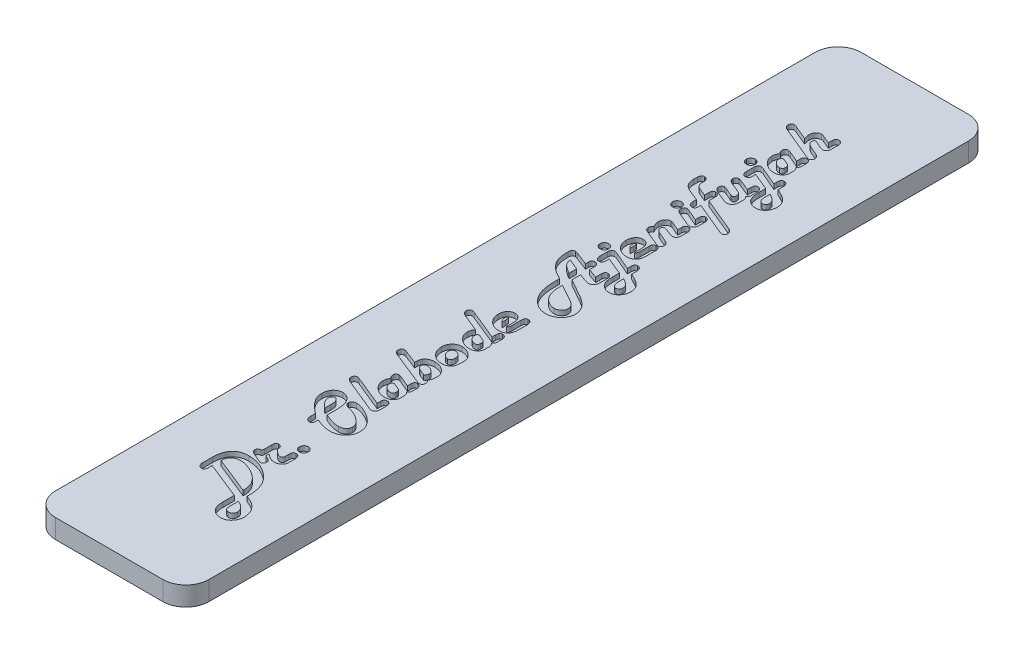
from build123d import *

# Parameters (mm, degrees)
BOSS_EXTRUDE1_DEPTH      = 66.675
BOSS_EXTRUDE1_DEPTH_BACK = 66.675
SKETCH3_W                = 25.4
SKETCH3_H                = 3.175
SKETCH5_OUTSIDE_W        = 54.556
SKETCH5_OUTSIDE_H        = 162.506
CUT_EXTRUDE2_DEPTH       = 68.947967225
CUT_EXTRUDE1_DEPTH       = 0.79375


with BuildPart() as part:
    # Sketch3 → Boss-Extrude1 (new, two sides: drawn at the far end of the back side and taken through both)
    with BuildSketch(Plane.XY.offset(-BOSS_EXTRUDE1_DEPTH_BACK)):
        Rectangle(SKETCH3_W, SKETCH3_H)
    extrude(amount=BOSS_EXTRUDE1_DEPTH + BOSS_EXTRUDE1_DEPTH_BACK)

    # Sketch5 outside → Cut-Extrude2 (cut, through all)
    with BuildSketch(Plane(origin=(0, 1.5875, 0), x_dir=(1, 0, 0), z_dir=(0, 1, 0))):
        Rectangle(SKETCH5_OUTSIDE_W, SKETCH5_OUTSIDE_H)
        with BuildLine():
            Line((12.7, -62.865), (12.7, 62.865))
            ThreePointArc((12.7, 62.865), (11.584076836, 65.559076836), (8.89, 66.675))
            Line((8.89, 66.675), (-8.89, 66.675))
            ThreePointArc((-8.89, 66.675), (-11.584076836, 65.559076836), (-12.7, 62.865))
            Line((-12.7, 62.865), (-12.7, -62.865))
            ThreePointArc((-12.7, -62.865), (-11.584076836, -65.559076836), (-8.89, -66.675))
            Line((-8.89, -66.675), (8.89, -66.675))
            ThreePointArc((8.89, -66.675), (11.584076836, -65.559076836), (12.7, -62.865))
        make_face(mode=Mode.SUBTRACT)
    extrude(amount=-CUT_EXTRUDE2_DEPTH, mode=Mode.SUBTRACT)

    # Sketch4 → Cut-Extrude1 (cut)
    # profile 1 of 23: a face of its own
    with BuildSketch(Plane(origin=(0, 1.5875, 0), x_dir=(1, 0, 0), z_dir=(0, 1, 0))):
        with BuildLine():
            Line((-3.37065122, -46.260081189), (-3.37065122, -46.774184707))
            Line((-3.37065122, -46.774184707), (-3.37065122, -46.914254827))
            add(Edge.make_bspline(
                [(-3.37065122, -46.914254827), (-3.372061398, -46.962570225), (-3.374703006, -47.053076754), (-3.395638346, -47.179797669), (-3.432017739, -47.28821225), (-3.484548055, -47.377824516), (-3.552479883, -47.448924675), (-3.63758649, -47.497252869), (-3.736529335, -47.527335268), (-3.807560564, -47.530060596), (-3.844734703, -47.531486894)],
                knots=[0, 0, 0, 0, 1.305737749, 2.445965353, 3.459324035, 4.379959175, 5.233349143, 6.085046436, 6.997810513, 8, 8, 8, 8], degree=3))
            add(Edge.make_bspline(
                [(-3.844734703, -47.531486894), (-3.893319638, -47.528598867), (-3.989202936, -47.522899289), (-4.126752349, -47.475057049), (-4.248823552, -47.393265336), (-4.356189972, -47.285575145), (-4.443071231, -47.154930055), (-4.507016845, -47.007532897), (-4.546552033, -46.846016676), (-4.550671649, -46.733366407), (-4.552781464, -46.675673853)],
                knots=[0, 0, 0, 0, 0.941902933, 1.858863449, 2.78744378, 3.773831386, 4.79357467, 5.815409039, 6.881186575, 8, 8, 8, 8], degree=3))
            Line((-4.552781464, -46.675673853), (-4.552781464, -46.535603733))
            Line((-4.552781464, -46.535603733), (-4.552781464, -45.013303198))
            add(Edge.make_bspline(
                [(-4.552781464, -45.013303198), (-4.550956206, -44.88803161), (-4.54741072, -44.644696826), (-4.513090532, -44.291240509), (-4.456829152, -43.960195676), (-4.377091402, -43.651663035), (-4.275169976, -43.36523718), (-4.152929493, -43.099836276), (-4.004020719, -42.858880304), (-3.834003279, -42.640242302), (-3.642855353, -42.445399548), (-3.43038721, -42.276396402), (-3.197750454, -42.133785391), (-2.94464877, -42.018397851), (-2.672360653, -41.927085246), (-2.380261894, -41.863429743), (-2.068520033, -41.823964835), (-1.854117791, -41.819933733), (-1.743682902, -41.817857382)],
                knots=[0, 0, 0, 0, 1.240121913, 2.408884614, 3.512215636, 4.562072732, 5.559962685, 6.519078054, 7.449661058, 8.358196616, 9.256317547, 10.145746268, 11.039719344, 11.951275398, 12.894325228, 13.877939151, 14.906963136, 16, 16, 16, 16], degree=3))
            add(Edge.make_bspline(
                [(-1.743682902, -41.817857382), (-1.572603417, -41.821782), (-1.232739151, -41.829578596), (-0.728602596, -41.898912257), (-0.23501345, -42.007313982), (0.247413515, -42.16104713), (0.719075314, -42.356957352), (1.17836012, -42.599232975), (1.629291191, -42.881879724), (1.912770877, -43.102129633), (2.056681124, -43.213940886)],
                knots=[0, 0, 0, 0, 0.99369571, 1.974062893, 2.951324249, 3.9272385, 4.912259598, 5.915104549, 6.941589699, 8, 8, 8, 8], degree=3))
            add(Edge.make_bspline(
                [(2.056681124, -43.213940886), (2.135991245, -43.279717989), (2.292699592, -43.409686534), (2.510816777, -43.618246691), (2.712499734, -43.832168348), (2.899120467, -44.051771018), (3.067388105, -44.279086325), (3.220810703, -44.511959011), (3.356680699, -44.751762243), (3.477314633, -44.998874655), (3.582530732, -45.255339444), (3.671579063, -45.523621848), (3.748507069, -45.803542697), (3.812045979, -46.096324347), (3.858268381, -46.401360415), (3.894878613, -46.71802046), (3.913989315, -47.047419502), (3.91741105, -47.271336128), (3.919151951, -47.385259846)],
                knots=[0, 0, 0, 0, 1.041972891, 2.058827374, 3.050103684, 4.014970579, 4.971989252, 5.909071109, 6.834104011, 7.757898592, 8.688895906, 9.635856426, 10.615406742, 11.624176682, 12.664286734, 13.734882699, 14.847559518, 16, 16, 16, 16], degree=3))
            Line((3.919151951, -47.385259846), (3.919151951, -47.751597083))
            Line((3.919151951, -47.751597083), (4.066918232, -47.814705599))
            add(Edge.make_bspline(
                [(4.066918232, -47.814705599), (4.13309071, -47.844493507), (4.260401566, -47.901803194), (4.444446598, -47.984075729), (4.611425699, -48.064817957), (4.764288333, -48.138236036), (4.901427965, -48.207296385), (5.022561868, -48.272325461), (5.129861579, -48.329996458), (5.251167259, -48.404569511), (5.392072422, -48.5010428), (5.556123636, -48.627182573), (5.716211985, -48.770639778), (5.817663131, -48.875616995), (5.869359008, -48.929109631)],
                knots=[0, 0, 0, 0, 1.222800361, 2.352575644, 3.396669397, 4.347862466, 5.210067408, 5.983579217, 6.664594993, 7.262130753, 8.381971782, 9.540587582, 10.746771362, 12, 12, 12, 12], degree=3))
            add(Edge.make_bspline(
                [(5.869359008, -48.929109631), (5.933752074, -49.001933097), (6.06051808, -49.145295428), (6.226112509, -49.375823012), (6.364360045, -49.615149675), (6.480245751, -49.861161536), (6.567670653, -50.116408206), (6.63090703, -50.379694057), (6.670860926, -50.650799154), (6.675247695, -50.834542429), (6.677455854, -50.927032882)],
                knots=[0, 0, 0, 0, 1.055914228, 2.078702545, 3.078046045, 4.055880218, 5.029205391, 6.004237832, 6.995397536, 8, 8, 8, 8], degree=3))
            add(Edge.make_bspline(
                [(6.677455854, -50.927032882), (6.67543939, -51.002509508), (6.671477973, -51.150786081), (6.647575401, -51.367866332), (6.603819128, -51.574289987), (6.54379522, -51.770660654), (6.466900227, -51.957453705), (6.372574304, -52.133840571), (6.261172968, -52.299375441), (6.133588255, -52.452839426), (5.992954887, -52.592147969), (5.842160069, -52.714421509), (5.681311403, -52.817013145), (5.512117723, -52.902584926), (5.331737415, -52.966509393), (5.143446693, -53.01513626), (4.945108295, -53.042903477), (4.809937924, -53.046343072), (4.741101887, -53.0480947)],
                knots=[0, 0, 0, 0, 1.126201464, 2.212463691, 3.25287726, 4.269850786, 5.272053028, 6.261782411, 7.249022054, 8.243830034, 9.23438794, 10.19795826, 11.134388982, 12.075812372, 13.02018767, 13.98375799, 14.973220915, 16, 16, 16, 16], degree=3))
            add(Edge.make_bspline(
                [(4.741101887, -53.0480947), (4.655651555, -53.045547606), (4.486360365, -53.040501392), (4.238146077, -52.987465615), (3.996700772, -52.910077333), (3.767610099, -52.797153913), (3.554008675, -52.658238754), (3.363702166, -52.494042589), (3.196643274, -52.307322116), (3.10809501, -52.166491756), (3.06333891, -52.095310037)],
                knots=[0, 0, 0, 0, 1.014242392, 2.009381349, 3.004557683, 4.021967388, 5.035219112, 6.025505851, 7.00200576, 8, 8, 8, 8], degree=3))
            add(Edge.make_bspline(
                [(3.06333891, -52.095310037), (3.036762184, -52.045988069), (2.982552932, -51.945384746), (2.917116917, -51.78263754), (2.862134481, -51.60797574), (2.815379811, -51.421017999), (2.7812278, -51.221255154), (2.754549848, -51.009211702), (2.739223806, -50.784626216), (2.737768158, -50.630497073), (2.737021707, -50.551460252)],
                knots=[0, 0, 0, 0, 0.84245226, 1.718372183, 2.633912599, 3.596293803, 4.615457363, 5.681185209, 6.810920853, 8, 8, 8, 8], degree=3))
            Line((2.737021707, -50.551460252), (2.737021707, -48.70746021))
            Line((2.737021707, -48.70746021), (-3.37065122, -46.260081189))
        make_face()
        with BuildLine():
            Line((2.737021707, -47.246728958), (2.737021707, -47.038932626))
            add(Edge.make_bspline(
                [(2.737021707, -47.038932626), (2.73576854, -46.972193701), (2.733287122, -46.840042831), (2.715579404, -46.643770053), (2.688710363, -46.4513208), (2.648134096, -46.263332432), (2.597343446, -46.079831246), (2.535809081, -45.900129748), (2.461118046, -45.72484122), (2.377612249, -45.552184029), (2.279046944, -45.385671645), (2.171880801, -45.222276174), (2.052268639, -45.063683115), (1.924037677, -44.907437317), (1.780232549, -44.758732171), (1.629329019, -44.610083035), (1.463440519, -44.468869795), (1.347440877, -44.378698631), (1.288604312, -44.332962614)],
                knots=[0, 0, 0, 0, 1.003752549, 1.98754731, 2.96218803, 3.924869515, 4.877913061, 5.824875223, 6.779479857, 7.742439712, 8.707376773, 9.687714611, 10.680189018, 11.694008127, 12.725763052, 13.790025714, 14.879071578, 16, 16, 16, 16], degree=3))
            add(Edge.make_bspline(
                [(1.288604312, -44.332962614), (1.171853445, -44.247973216), (0.93894921, -44.078429372), (0.567764559, -43.858021284), (0.18349524, -43.662670457), (-0.21154301, -43.498697827), (-0.605230487, -43.365157551), (-0.98902194, -43.268633949), (-1.357967294, -43.208174681), (-1.599810744, -43.200664526), (-1.717515957, -43.197009333)],
                knots=[0, 0, 0, 0, 1.061151743, 2.116872814, 3.169496409, 4.227969904, 5.258553914, 6.222792805, 7.135033211, 8, 8, 8, 8], degree=3))
            add(Edge.make_bspline(
                [(-1.717515957, -43.197009333), (-1.779657501, -43.198011291), (-1.901202903, -43.199971064), (-2.078826474, -43.220567096), (-2.246518137, -43.253440813), (-2.403352382, -43.302118832), (-2.550676001, -43.361890306), (-2.688289163, -43.435751346), (-2.814749762, -43.524191224), (-2.931062013, -43.624128726), (-3.033528195, -43.737228034), (-3.125893034, -43.858624238), (-3.200612099, -43.991916423), (-3.262735909, -44.133731934), (-3.312926052, -44.284948448), (-3.344846618, -44.446877351), (-3.368349446, -44.617550478), (-3.369870217, -44.734613596), (-3.37065122, -44.794732241)],
                knots=[0, 0, 0, 0, 1.145531499, 2.240595844, 3.292755274, 4.292422607, 5.264114043, 6.220902991, 7.165828125, 8.104908158, 9.042461542, 9.975419986, 10.911970153, 11.852526766, 12.827988561, 13.843075609, 14.892295267, 16, 16, 16, 16], degree=3))
            Line((-3.37065122, -44.794732241), (2.737021707, -47.246728958))
        make_face(mode=Mode.SUBTRACT)
        with BuildLine():
            Line((3.919151951, -49.210789103), (3.919151951, -50.588401822))
            add(Edge.make_bspline(
                [(3.919151951, -50.588401822), (3.921443521, -50.665505488), (3.925731458, -50.809780224), (3.95872412, -51.011681511), (4.01529305, -51.184114446), (4.100418841, -51.324803577), (4.20718401, -51.437591362), (4.341173858, -51.515637236), (4.497868613, -51.562940006), (4.609910699, -51.567851996), (4.668757978, -51.570431895)],
                knots=[0, 0, 0, 0, 1.31364871, 2.458071474, 3.475829816, 4.38621616, 5.23967168, 6.094559773, 6.99921559, 8, 8, 8, 8], degree=3))
            add(Edge.make_bspline(
                [(4.668757978, -51.570431895), (4.718353928, -51.56798005), (4.815296979, -51.563187535), (4.953408909, -51.519222078), (5.080276035, -51.450709037), (5.188812456, -51.352720239), (5.282174281, -51.238518493), (5.349078204, -51.107386993), (5.388702811, -50.963680483), (5.394064323, -50.864175397), (5.396814756, -50.813129707)],
                knots=[0, 0, 0, 0, 1.015443884, 1.984844108, 2.946375274, 3.953924431, 4.965428653, 5.959234333, 6.953095811, 8, 8, 8, 8], degree=3))
            add(Edge.make_bspline(
                [(5.396814756, -50.813129707), (5.395622497, -50.774068136), (5.393240347, -50.696022626), (5.374164808, -50.579852685), (5.342403466, -50.465369405), (5.301957904, -50.35104485), (5.245309678, -50.239732557), (5.176550549, -50.130521334), (5.098951173, -50.020275569), (4.972570779, -49.877930988), (4.791437665, -49.704963964), (4.53641947, -49.519012234), (4.243868552, -49.350007129), (4.030030137, -49.258326685), (3.919151951, -49.210789103)],
                knots=[0, 0, 0, 0, 0.609246736, 1.21728261, 1.830931323, 2.461525313, 3.105941494, 3.774613737, 4.474427454, 5.206422339, 6.740961797, 8.372497183, 10.119089455, 12, 12, 12, 12], degree=3))
        make_face(mode=Mode.SUBTRACT)
    # profile 2 of 23: a face of its own
    with BuildSketch(Plane(origin=(0, 1.5875, 0), x_dir=(1, 0, 0), z_dir=(0, 1, 0))):
        with BuildLine():
            Line((-0.316814756, -40.424852342), (0.104934836, -40.60802096))
            add(Edge.make_bspline(
                [(0.104934836, -40.60802096), (0.149532874, -40.628673237), (0.234488722, -40.668014245), (0.3486957, -40.738290309), (0.447705977, -40.810201623), (0.528353565, -40.888763637), (0.59156896, -40.972597897), (0.635193929, -41.062051224), (0.662815573, -41.155902612), (0.666458788, -41.220448918), (0.66829378, -41.252959205)],
                knots=[0, 0, 0, 0, 1.297501196, 2.471640463, 3.537215363, 4.524637192, 5.43567625, 6.296618738, 7.14205136, 8, 8, 8, 8], degree=3))
            add(Edge.make_bspline(
                [(0.66829378, -41.252959205), (0.667208208, -41.291625284), (0.665096322, -41.366846768), (0.637436217, -41.473777987), (0.596119648, -41.572194141), (0.535875918, -41.656654478), (0.465847824, -41.72877782), (0.384416248, -41.781017948), (0.293731113, -41.81124998), (0.230857753, -41.815627387), (0.198827993, -41.817857382)],
                knots=[0, 0, 0, 0, 1.131994738, 2.202197021, 3.220602635, 4.248319073, 5.22801886, 6.155513921, 7.060358075, 8, 8, 8, 8], degree=3))
            add(Edge.make_bspline(
                [(0.198827993, -41.817857382), (0.176163744, -41.815849655), (0.123459686, -41.811180834), (0.035829842, -41.787734943), (-0.070948493, -41.749534503), (-0.148137339, -41.718143465), (-0.190597725, -41.700875743)],
                knots=[0, 0, 0, 0, 0.667539348, 1.552314029, 2.65356594, 4, 4, 4, 4], degree=3))
            Line((-0.190597725, -41.700875743), (-1.585141997, -41.102114461))
            add(Edge.make_bspline(
                [(-1.585141997, -41.102114461), (-1.62513232, -41.084056132), (-1.701494339, -41.049573528), (-1.80421069, -40.985108284), (-1.892356156, -40.916830181), (-1.964678512, -40.841853817), (-2.021238898, -40.761642738), (-2.059780668, -40.674645476), (-2.086346002, -40.582905711), (-2.088775286, -40.518937499), (-2.090010122, -40.486421625)],
                knots=[0, 0, 0, 0, 1.242093141, 2.371792344, 3.427691145, 4.394328043, 5.313892613, 6.192305435, 7.081125362, 8, 8, 8, 8], degree=3))
            add(Edge.make_bspline(
                [(-2.090010122, -40.486421625), (-2.088683095, -40.455064709), (-2.086163908, -40.395537754), (-2.071143025, -40.310162108), (-2.043699207, -40.234474434), (-2.004379862, -40.168295879), (-1.95418029, -40.111212239), (-1.891603123, -40.065680999), (-1.819292317, -40.027186091), (-1.765609728, -40.011374498), (-1.737525974, -40.003102749)],
                knots=[0, 0, 0, 0, 1.15314347, 2.189090296, 3.173792814, 4.095790583, 5.004376053, 5.947550008, 6.926271946, 8, 8, 8, 8], degree=3))
            Line((-1.737525974, -40.003102749), (-1.582063533, -39.960004251))
            add(Edge.make_bspline(
                [(-1.582063533, -39.960004251), (-1.563360313, -39.955017268), (-1.529103006, -39.94588298), (-1.484677442, -39.923967494), (-1.451181709, -39.898297913), (-1.427403636, -39.863664685), (-1.414803466, -39.814983023), (-1.406685238, -39.747357991), (-1.400594803, -39.657378215), (-1.40049132, -39.589570567), (-1.400434147, -39.552107747)],
                knots=[0, 0, 0, 0, 0.926850573, 1.697643703, 2.362895762, 2.92973869, 3.677374781, 4.746381598, 6.202419277, 8, 8, 8, 8], degree=3))
            Line((-1.400434147, -39.552107747), (-1.400434147, -38.336114397))
            add(Edge.make_bspline(
                [(-1.400434147, -38.336114397), (-1.399080807, -38.284715762), (-1.396549747, -38.188588301), (-1.374989644, -38.054029293), (-1.340833134, -37.939265978), (-1.29193413, -37.843458304), (-1.225126043, -37.770093523), (-1.144015549, -37.71778176), (-1.048642937, -37.686074871), (-0.980475393, -37.682349844), (-0.944821448, -37.680401528)],
                knots=[0, 0, 0, 0, 1.361355543, 2.546053047, 3.599677592, 4.524244374, 5.371169927, 6.197098625, 7.057021238, 8, 8, 8, 8], degree=3))
            add(Edge.make_bspline(
                [(-0.944821448, -37.680401528), (-0.89521449, -37.682148322), (-0.800818355, -37.685472264), (-0.669903992, -37.72729531), (-0.557100048, -37.792728202), (-0.468301866, -37.889357497), (-0.397335843, -38.009674812), (-0.349990419, -38.156711111), (-0.320674258, -38.328783763), (-0.318158995, -38.451930286), (-0.316814756, -38.517743784)],
                knots=[0, 0, 0, 0, 0.994284648, 1.892005291, 2.734571892, 3.588753721, 4.500369607, 5.525254763, 6.677415825, 8, 8, 8, 8], degree=3))
            Line((-0.316814756, -38.517743784), (-0.266020097, -38.571616907))
            add(Edge.make_bspline(
                [(-0.266020097, -38.571616907), (-0.203938754, -38.633206243), (-0.0851058, -38.751097422), (0.092298668, -38.910755196), (0.259560488, -39.0455146), (0.413871015, -39.157806191), (0.559633448, -39.243322028), (0.693141861, -39.305743779), (0.816747948, -39.346847146), (0.896865905, -39.352449001), (0.934580932, -39.35508604)],
                knots=[0, 0, 0, 0, 1.435762249, 2.748263184, 3.91660617, 4.961556361, 5.879059361, 6.685751502, 7.381325737, 8, 8, 8, 8], degree=3))
            add(Edge.make_bspline(
                [(0.934580932, -39.35508604), (0.9676141, -39.354433202), (1.030382831, -39.353192698), (1.117101755, -39.329741628), (1.193862058, -39.299671956), (1.25367307, -39.249042894), (1.301930375, -39.187058695), (1.33474037, -39.110800056), (1.355529795, -39.021657601), (1.357054283, -38.958099374), (1.357869756, -38.924101055)],
                knots=[0, 0, 0, 0, 1.140484469, 2.167117703, 3.098941929, 3.971150526, 4.846255631, 5.80154673, 6.824011975, 8, 8, 8, 8], degree=3))
            Line((1.357869756, -38.924101055), (1.357869756, -38.268388186))
            add(Edge.make_bspline(
                [(1.357869756, -38.268388186), (1.359321057, -38.214456007), (1.362029867, -38.113793244), (1.382304162, -37.972466795), (1.420690012, -37.852958016), (1.47220184, -37.753356016), (1.540927346, -37.675898517), (1.625050742, -37.620362842), (1.725446826, -37.587158517), (1.797315899, -37.583703706), (1.835031703, -37.581890674)],
                knots=[0, 0, 0, 0, 1.364190584, 2.546219988, 3.596843527, 4.525897283, 5.362221888, 6.186477391, 7.048290713, 8, 8, 8, 8], degree=3))
            add(Edge.make_bspline(
                [(1.835031703, -37.581890674), (1.88822888, -37.584677108), (1.990523531, -37.590035237), (2.134226068, -37.635834318), (2.259027293, -37.711869703), (2.360953934, -37.819659739), (2.444017369, -37.952149141), (2.499007517, -38.111098043), (2.535674154, -38.291338085), (2.538509074, -38.419537275), (2.54, -38.486959142)],
                knots=[0, 0, 0, 0, 0.982615473, 1.889504555, 2.759142238, 3.658944971, 4.610088785, 5.631441668, 6.75433984, 8, 8, 8, 8], degree=3))
            Line((2.54, -38.486959142), (2.54, -39.505930785))
            add(Edge.make_bspline(
                [(2.54, -39.505930785), (2.538779206, -39.546530871), (2.53638853, -39.626037862), (2.518702701, -39.742497784), (2.4917955, -39.853826045), (2.451203129, -39.958957058), (2.39971687, -40.058282826), (2.338326365, -40.152998906), (2.263646141, -40.240601802), (2.179151909, -40.322161861), (2.085472566, -40.395372565), (1.985466779, -40.460655519), (1.877874597, -40.514684854), (1.764154844, -40.559524403), (1.642807901, -40.593238196), (1.515113363, -40.617412632), (1.380859199, -40.633638656), (1.289166187, -40.635022002), (1.242427349, -40.635727138)],
                knots=[0, 0, 0, 0, 1.009407673, 1.976719137, 2.923785669, 3.852797958, 4.771676065, 5.702527031, 6.65345443, 7.628144937, 8.618662201, 9.606215811, 10.593522047, 11.607757909, 12.641947342, 13.720607507, 14.838121302, 16, 16, 16, 16], degree=3))
            add(Edge.make_bspline(
                [(1.242427349, -40.635727138), (1.181753979, -40.633544111), (1.060155913, -40.629169013), (0.879510535, -40.597040853), (0.70113609, -40.546485654), (0.522732444, -40.471504764), (0.336985257, -40.369177354), (0.135556181, -40.237035616), (-0.085711106, -40.073261978), (-0.236798973, -39.949909215), (-0.316814756, -39.884581879)],
                knots=[0, 0, 0, 0, 0.822710096, 1.64882809, 2.481516469, 3.333299355, 4.267584386, 5.354441073, 6.598918144, 8, 8, 8, 8], degree=3))
            Line((-0.316814756, -39.884581879), (-0.316814756, -40.424852342))
        make_face()
    # profile 3 of 23: a face of its own
    with BuildSketch(Plane(origin=(0, 1.5875, 0), x_dir=(1, 0, 0), z_dir=(0, 1, 0))):
        with BuildLine():
            add(Edge.make_bspline(
                [(1.160848049, -36.347426539), (1.163441455, -36.298382982), (1.168502616, -36.202672039), (1.210646111, -36.064730878), (1.279530868, -35.937856796), (1.375116725, -35.825942277), (1.487031244, -35.73035642), (1.613905326, -35.661471663), (1.751846486, -35.619328169), (1.84755743, -35.614267007), (1.896600987, -35.611673601)],
                knots=[0, 0, 0, 0, 1.018015329, 1.986707578, 2.970091954, 4, 5.029908046, 6.013292422, 6.981984671, 8, 8, 8, 8], degree=3))
            add(Edge.make_bspline(
                [(1.896600987, -35.611673601), (1.946141079, -35.61432495), (2.043319757, -35.619525882), (2.183408321, -35.661153073), (2.312080004, -35.72990804), (2.424215588, -35.825984114), (2.519834802, -35.937846148), (2.588711055, -36.064733611), (2.630856743, -36.202671319), (2.635917602, -36.298382738), (2.638510854, -36.347426539)],
                knots=[0, 0, 0, 0, 1.023458974, 2.007634331, 2.995409192, 4.02013336, 5.044857529, 6.023292197, 6.987108688, 8, 8, 8, 8], degree=3))
            add(Edge.make_bspline(
                [(2.638510854, -36.347426539), (2.635859661, -36.396966879), (2.630659038, -36.494146043), (2.589029598, -36.634231066), (2.520283245, -36.762916308), (2.424173775, -36.874999327), (2.312090756, -36.971108797), (2.183405514, -37.03985515), (2.043320491, -37.08148459), (1.946141327, -37.086685213), (1.896600987, -37.089336406)],
                knots=[0, 0, 0, 0, 1.018333356, 1.997579833, 2.980407786, 4, 5.019592214, 6.002420167, 6.981666644, 8, 8, 8, 8], degree=3))
            add(Edge.make_bspline(
                [(1.896600987, -37.089336406), (1.847557186, -37.086743154), (1.751845767, -37.081682295), (1.613908059, -37.039536607), (1.487020596, -36.970660354), (1.375158562, -36.87504114), (1.279082488, -36.762905556), (1.210327521, -36.634233873), (1.16870033, -36.494145309), (1.163499398, -36.396966631), (1.160848049, -36.347426539)],
                knots=[0, 0, 0, 0, 1.012891312, 1.976707803, 2.955142471, 3.97986664, 5.004590808, 5.992365669, 6.976541026, 8, 8, 8, 8], degree=3))
        make_face()
    # profile 4 of 23: a face of its own
    with BuildSketch(Plane(origin=(0, 1.5875, 0), x_dir=(1, 0, 0), z_dir=(0, 1, 0))):
        with BuildLine():
            Line((-1.104901586, -30.947800372), (-1.104901586, -31.206391363))
            add(Edge.make_bspline(
                [(-1.104901586, -31.206391363), (-1.106315706, -31.265977463), (-1.108959643, -31.377383732), (-1.12966481, -31.533097347), (-1.165568658, -31.66524109), (-1.216697346, -31.774820936), (-1.282531715, -31.862872859), (-1.36803051, -31.923082567), (-1.466795727, -31.960275773), (-1.537597441, -31.964551482), (-1.574367373, -31.966772015)],
                knots=[0, 0, 0, 0, 1.419195962, 2.653426324, 3.733010354, 4.667897623, 5.521241497, 6.318371221, 7.126668378, 8, 8, 8, 8], degree=3))
            add(Edge.make_bspline(
                [(-1.574367373, -31.966772015), (-1.627619126, -31.963641176), (-1.73094593, -31.957566268), (-1.876442365, -31.906797582), (-2.002040449, -31.82212946), (-2.106659253, -31.705170404), (-2.187635438, -31.558018372), (-2.245451696, -31.38437103), (-2.280747081, -31.184710121), (-2.284856739, -31.042877287), (-2.28703183, -30.96781039)],
                knots=[0, 0, 0, 0, 0.92337427, 1.791665163, 2.639677553, 3.52952705, 4.491466319, 5.537308167, 6.69658787, 8, 8, 8, 8], degree=3))
            Line((-2.28703183, -30.96781039), (-2.28703183, -30.241292844))
            Line((-2.28703183, -30.241292844), (-2.480975073, -30.095065795))
            add(Edge.make_bspline(
                [(-2.480975073, -30.095065795), (-2.569228575, -30.027997244), (-2.741907971, -29.896768945), (-2.987435009, -29.692409021), (-3.215995795, -29.488169707), (-3.429772273, -29.285045965), (-3.624646008, -29.080831493), (-3.802862259, -28.876422398), (-3.964783996, -28.672770428), (-4.108006807, -28.466904528), (-4.236314558, -28.262446036), (-4.348064191, -28.057841789), (-4.439923411, -27.851897524), (-4.518447224, -27.647508049), (-4.576042854, -27.441581654), (-4.620656814, -27.236247794), (-4.644963112, -27.030011621), (-4.649192135, -26.892491664), (-4.651292318, -26.824197607)],
                knots=[0, 0, 0, 0, 1.30802669, 2.559323489, 3.768676217, 4.924993305, 6.038505379, 7.098562152, 8.124610483, 9.107291049, 10.056570851, 10.972332677, 11.8558165, 12.716172862, 13.553726262, 14.376707029, 15.193853278, 16, 16, 16, 16], degree=3))
            add(Edge.make_bspline(
                [(-4.651292318, -26.824197607), (-4.649570608, -26.757969086), (-4.646186099, -26.627778168), (-4.626835138, -26.437123681), (-4.591333812, -26.255201623), (-4.540188662, -26.083539122), (-4.477535765, -25.919982443), (-4.398255711, -25.76723879), (-4.30558209, -25.623372003), (-4.199629741, -25.48960944), (-4.082167188, -25.36872802), (-3.954935444, -25.263365769), (-3.820099761, -25.17298153), (-3.676999534, -25.09937407), (-3.525502803, -25.040889159), (-3.36548545, -25.002437636), (-3.197583824, -24.976129569), (-3.0829213, -24.973728467), (-3.024324, -24.972501405)],
                knots=[0, 0, 0, 0, 1.150118269, 2.260883243, 3.323180519, 4.363394127, 5.367619612, 6.359758966, 7.345759456, 8.335014678, 9.317830416, 10.266874698, 11.198403929, 12.130784805, 13.055687197, 14.010733927, 14.983402628, 16, 16, 16, 16], degree=3))
            add(Edge.make_bspline(
                [(-3.024324, -24.972501405), (-2.942515612, -24.975313908), (-2.78215628, -24.980826925), (-2.548881097, -25.028505259), (-2.329925104, -25.105505608), (-2.125297091, -25.214235237), (-1.938301149, -25.357510028), (-1.762559574, -25.527695153), (-1.603586951, -25.730818845), (-1.51415805, -25.882613125), (-1.468160359, -25.960688405)],
                knots=[0, 0, 0, 0, 1.009395235, 1.97859838, 2.92646369, 3.86752839, 4.826781332, 5.82594365, 6.881775663, 8, 8, 8, 8], degree=3))
            add(Edge.make_bspline(
                [(-1.468160359, -25.960688405), (-1.438830164, -26.018683532), (-1.378039287, -26.138886437), (-1.305723122, -26.335870841), (-1.242195453, -26.551669184), (-1.192423889, -26.788569573), (-1.152155564, -27.04590853), (-1.125804211, -27.324008157), (-1.108393516, -27.622324629), (-1.106091865, -27.827749945), (-1.104901586, -27.933983943)],
                knots=[0, 0, 0, 0, 0.769448956, 1.594789189, 2.481600085, 3.433081523, 4.46051123, 5.566245002, 6.741403793, 8, 8, 8, 8], degree=3))
            Line((-1.104901586, -27.933983943), (-1.104901586, -29.493226049))
            add(Edge.make_bspline(
                [(-1.104901586, -29.493226049), (-0.98271661, -29.549134891), (-0.745378116, -29.657735153), (-0.39140155, -29.79968031), (-0.051924552, -29.919746548), (0.273941601, -30.019467335), (0.585884214, -30.096447039), (0.883731693, -30.152937504), (1.167754228, -30.186763867), (1.35265622, -30.191348363), (1.442527521, -30.193576649)],
                knots=[0, 0, 0, 0, 1.211445405, 2.353174967, 3.437405929, 4.457477985, 5.424691169, 6.332973357, 7.189744516, 8, 8, 8, 8], degree=3))
            add(Edge.make_bspline(
                [(1.442527521, -30.193576649), (1.490283838, -30.192758934), (1.583441029, -30.191163834), (1.719719183, -30.176710394), (1.849282242, -30.154702961), (1.97087751, -30.119955925), (2.085538803, -30.078828072), (2.192901409, -30.028229313), (2.291202014, -29.965448375), (2.383739816, -29.897034523), (2.467268799, -29.820006367), (2.539425407, -29.735642083), (2.600405541, -29.6444939), (2.651326659, -29.548316512), (2.689802278, -29.44523883), (2.718252308, -29.336535134), (2.732709637, -29.221167262), (2.735569233, -29.142313366), (2.737021707, -29.102261098)],
                knots=[0, 0, 0, 0, 1.202424749, 2.345543342, 3.448210986, 4.507941062, 5.525875972, 6.514263026, 7.489553778, 8.458747024, 9.409764382, 10.344666136, 11.247860876, 12.166909583, 13.078935934, 14.012944157, 14.990714502, 16, 16, 16, 16], degree=3))
            add(Edge.make_bspline(
                [(2.737021707, -29.102261098), (2.734693161, -29.045108437), (2.729983916, -28.929523035), (2.689617054, -28.757226619), (2.622998872, -28.586417833), (2.534050319, -28.414193154), (2.414362288, -28.245912764), (2.274474166, -28.074560385), (2.104206162, -27.908101336), (1.914274996, -27.74025434), (1.704502962, -27.578273135), (1.479276648, -27.425738754), (1.241197768, -27.284562295), (0.989629467, -27.154648816), (0.726291885, -27.034867207), (0.448809216, -26.927598606), (0.159860843, -26.827603259), (-0.039916165, -26.773277686), (-0.141342298, -26.745696771)],
                knots=[0, 0, 0, 0, 0.695010846, 1.405588225, 2.140927651, 2.923070066, 3.758055212, 4.649627007, 5.61231393, 6.65218466, 7.733968257, 8.835615208, 9.96128691, 11.100921686, 12.280380977, 13.480703348, 14.720961327, 16, 16, 16, 16], degree=3))
            Line((-0.141342298, -26.745696771), (-0.456884876, -26.66411747))
            add(Edge.make_bspline(
                [(-0.456884876, -26.66411747), (-0.508127828, -26.649490996), (-0.605361705, -26.621737153), (-0.738003156, -26.56205991), (-0.851691908, -26.493884472), (-0.944663314, -26.412600931), (-1.016517249, -26.320556603), (-1.069457548, -26.218115735), (-1.098209791, -26.103829823), (-1.102634034, -26.024457489), (-1.104901586, -25.983776887)],
                knots=[0, 0, 0, 0, 1.250445841, 2.372730157, 3.406396095, 4.354352236, 5.256122782, 6.134799598, 7.044031207, 8, 8, 8, 8], degree=3))
            add(Edge.make_bspline(
                [(-1.104901586, -25.983776887), (-1.102756381, -25.940387917), (-1.098553002, -25.855370276), (-1.058839093, -25.734217523), (-0.991895872, -25.627034748), (-0.901772763, -25.534833887), (-0.791876827, -25.458558518), (-0.664249681, -25.40556713), (-0.522238124, -25.371778903), (-0.422716309, -25.368341723), (-0.370687879, -25.366544819)],
                knots=[0, 0, 0, 0, 0.967389218, 1.895531301, 2.811843988, 3.768576709, 4.757598997, 5.779755732, 6.839291463, 8, 8, 8, 8], degree=3))
            add(Edge.make_bspline(
                [(-0.370687879, -25.366544819), (-0.282818575, -25.369494696), (-0.102132355, -25.375560548), (0.174028705, -25.417559764), (0.461145117, -25.485851801), (0.75926983, -25.582489089), (1.068622339, -25.706836798), (1.39059015, -25.856211102), (1.723434989, -26.034078912), (1.945409234, -26.167486062), (2.059759588, -26.236210949)],
                knots=[0, 0, 0, 0, 0.807046067, 1.659534055, 2.560354543, 3.515755023, 4.53535331, 5.621298469, 6.774608457, 8, 8, 8, 8], degree=3))
            add(Edge.make_bspline(
                [(2.059759588, -26.236210949), (2.13919014, -26.286885318), (2.294956598, -26.386259762), (2.517285895, -26.543377532), (2.723387683, -26.705734272), (2.916651861, -26.869264268), (3.092087567, -27.039273721), (3.252946566, -27.212365494), (3.400015744, -27.388531026), (3.528704371, -27.571395833), (3.645326023, -27.755307743), (3.743864344, -27.944799466), (3.829114632, -28.137265621), (3.89881595, -28.334196154), (3.950479014, -28.535357527), (3.989608258, -28.739322642), (4.013289735, -28.947777873), (4.01619712, -29.088347861), (4.017662805, -29.159212686)],
                knots=[0, 0, 0, 0, 1.227045475, 2.406284763, 3.543910265, 4.643470051, 5.702101736, 6.723462229, 7.720261343, 8.688194524, 9.633841195, 10.554483101, 11.467086441, 12.373774163, 13.271726755, 14.169505271, 15.077202105, 16, 16, 16, 16], degree=3))
            add(Edge.make_bspline(
                [(4.017662805, -29.159212686), (4.016010437, -29.246066842), (4.01277897, -29.415923862), (3.975172312, -29.664169582), (3.919317055, -29.900676357), (3.838967324, -30.125397286), (3.734366485, -30.337194391), (3.610442294, -30.539160614), (3.458530498, -30.725374823), (3.28901196, -30.900624569), (3.10049281, -31.058195051), (2.897219219, -31.19612493), (2.681690726, -31.313866345), (2.451542036, -31.407754955), (2.209275478, -31.481341773), (1.95407251, -31.536011298), (1.685434947, -31.566266474), (1.502116582, -31.570546649), (1.408664415, -31.5727286)],
                knots=[0, 0, 0, 0, 1.044742485, 2.043158921, 3.015421232, 3.966880159, 4.908848942, 5.854919629, 6.812792487, 7.7955728, 8.786490818, 9.764699265, 10.748624071, 11.737364435, 12.751401624, 13.793218679, 14.87502544, 16, 16, 16, 16], degree=3))
            add(Edge.make_bspline(
                [(1.408664415, -31.5727286), (1.316235438, -31.570999671), (1.127852793, -31.567475882), (0.839998477, -31.53623813), (0.541865539, -31.487310366), (0.2329465, -31.416665681), (-0.086935599, -31.328705793), (-0.418270681, -31.22305421), (-0.758945054, -31.093905323), (-0.98771548, -30.997290608), (-1.104901586, -30.947800372)],
                knots=[0, 0, 0, 0, 0.850453706, 1.733338647, 2.661808821, 3.62984345, 4.648257091, 5.714515583, 6.829276037, 8, 8, 8, 8], degree=3))
        make_face()
        with BuildLine():
            Line((-2.28703183, -28.682050738), (-2.28703183, -27.669236024))
            add(Edge.make_bspline(
                [(-2.28703183, -27.669236024), (-2.287746558, -27.615870857), (-2.289128671, -27.512675543), (-2.296196895, -27.363160358), (-2.310642076, -27.224096197), (-2.327962116, -27.095399777), (-2.353079228, -26.976688211), (-2.383238641, -26.868640135), (-2.418665499, -26.770067817), (-2.460050773, -26.682505321), (-2.50652145, -26.604352724), (-2.558027824, -26.536405466), (-2.61700229, -26.480042421), (-2.678964409, -26.431613934), (-2.748778663, -26.396046452), (-2.823111132, -26.369423348), (-2.903620789, -26.353878834), (-2.959097472, -26.352404864), (-2.98738243, -26.351653356)],
                knots=[0, 0, 0, 0, 1.535960571, 2.970175942, 4.305755099, 5.558702054, 6.705526926, 7.794722329, 8.785043725, 9.716363504, 10.577368943, 11.398450277, 12.160731187, 12.919715576, 13.652835291, 14.404748467, 15.186656079, 16, 16, 16, 16], degree=3))
            add(Edge.make_bspline(
                [(-2.98738243, -26.351653356), (-3.020513894, -26.353612139), (-3.08587327, -26.357476286), (-3.178493594, -26.391769443), (-3.263101308, -26.445753093), (-3.335375237, -26.521428309), (-3.395764044, -26.612493604), (-3.439193029, -26.71692155), (-3.463626495, -26.833347192), (-3.467266867, -26.914383439), (-3.469162074, -26.956571567)],
                knots=[0, 0, 0, 0, 0.920003968, 1.814917814, 2.714724113, 3.694907296, 4.705553796, 5.743216766, 6.825100332, 8, 8, 8, 8], degree=3))
            add(Edge.make_bspline(
                [(-3.469162074, -26.956571567), (-3.464988102, -27.025709557), (-3.456376407, -27.168354347), (-3.392920831, -27.384206029), (-3.293475581, -27.606661168), (-3.15343526, -27.832329824), (-2.982570431, -28.059192238), (-2.77763935, -28.276966174), (-2.545909183, -28.488105589), (-2.374878918, -28.616237656), (-2.28703183, -28.682050738)],
                knots=[0, 0, 0, 0, 0.766929876, 1.582321849, 2.48000381, 3.466751747, 4.524052777, 5.628490565, 6.781910335, 8, 8, 8, 8], degree=3))
        make_face(mode=Mode.SUBTRACT)
    # profile 5 of 23: a face of its own
    with BuildSketch(Plane(origin=(0, 1.5875, 0), x_dir=(1, 0, 0), z_dir=(0, 1, 0))):
        with BuildLine():
            Line((1.357869756, -23.682624914), (1.357869756, -23.137736755))
            add(Edge.make_bspline(
                [(1.357869756, -23.137736755), (1.359070807, -23.088352479), (1.361325659, -22.995638457), (1.384846634, -22.866829995), (1.419960701, -22.755933126), (1.47547436, -22.666256701), (1.544239596, -22.593892124), (1.630218731, -22.544039517), (1.730916455, -22.513625216), (1.802983488, -22.511079586), (1.841188632, -22.509730063)],
                knots=[0, 0, 0, 0, 1.309866294, 2.459142491, 3.467464394, 4.378877924, 5.236448562, 6.091742891, 6.988369101, 8, 8, 8, 8], degree=3))
            add(Edge.make_bspline(
                [(1.841188632, -22.509730063), (1.893275092, -22.512215902), (1.993627607, -22.517005251), (2.135736998, -22.558633266), (2.257438717, -22.632434283), (2.361027284, -22.731236004), (2.443131154, -22.85590569), (2.499009032, -23.004249516), (2.535729948, -23.172896883), (2.538525682, -23.29298156), (2.54, -23.356307712)],
                knots=[0, 0, 0, 0, 1.005327757, 1.936917359, 2.82618379, 3.730792979, 4.682219187, 5.683775513, 6.778548722, 8, 8, 8, 8], degree=3))
            Line((2.54, -23.356307712), (2.54, -24.290621589))
            add(Edge.make_bspline(
                [(2.54, -24.290621589), (2.538302221, -24.354927932), (2.535069893, -24.477358031), (2.500774101, -24.650906452), (2.444479149, -24.804209155), (2.364306452, -24.934572099), (2.265164192, -25.039809295), (2.148094713, -25.11685629), (2.013449116, -25.160509048), (1.918967834, -25.166464087), (1.870434041, -25.169523112)],
                knots=[0, 0, 0, 0, 1.241432907, 2.363511102, 3.402225189, 4.381846537, 5.300609504, 6.175237008, 7.062643248, 8, 8, 8, 8], degree=3))
            add(Edge.make_bspline(
                [(1.870434041, -25.169523112), (1.838991863, -25.167354442), (1.76636806, -25.162345341), (1.645954802, -25.128829976), (1.498441679, -25.081680236), (1.392522361, -25.039909904), (1.334781275, -25.017139135)],
                knots=[0, 0, 0, 0, 0.674748729, 1.558505876, 2.669038612, 4, 4, 4, 4], degree=3))
            Line((1.334781275, -25.017139135), (-3.830881615, -22.888381157))
            Line((-3.830881615, -22.888381157), (-3.970951735, -22.831429569))
            add(Edge.make_bspline(
                [(-3.970951735, -22.831429569), (-4.017326616, -22.811219866), (-4.10631331, -22.772440367), (-4.22375288, -22.694889201), (-4.325819907, -22.612456908), (-4.408316231, -22.518424684), (-4.474333825, -22.416793739), (-4.519154442, -22.304270457), (-4.547824424, -22.183826519), (-4.55110789, -22.099948339), (-4.552781464, -22.057195829)],
                knots=[0, 0, 0, 0, 1.172289605, 2.249454275, 3.256072104, 4.209702834, 5.141584597, 6.05516676, 7.008723089, 8, 8, 8, 8], degree=3))
            add(Edge.make_bspline(
                [(-4.552781464, -22.057195829), (-4.550973515, -22.021627626), (-4.547437, -21.952052928), (-4.520523287, -21.851544754), (-4.475466886, -21.759177523), (-4.412118772, -21.678558517), (-4.337454375, -21.610682932), (-4.253028719, -21.560071764), (-4.160282154, -21.529428795), (-4.095854234, -21.526235007), (-4.06330566, -21.524621526)],
                knots=[0, 0, 0, 0, 1.061210962, 2.075826869, 3.083127833, 4.109819504, 5.118866931, 6.080623096, 7.030343019, 8, 8, 8, 8], degree=3))
            add(Edge.make_bspline(
                [(-4.06330566, -21.524621526), (-4.036549109, -21.525438752), (-3.981076141, -21.527133062), (-3.895745962, -21.544367319), (-3.805032257, -21.568455455), (-3.743997683, -21.591287498), (-3.712360744, -21.603122363)],
                knots=[0, 0, 0, 0, 0.886930248, 1.83882642, 2.879767429, 4, 4, 4, 4], degree=3))
            Line((-3.712360744, -21.603122363), (-3.573829856, -21.66007395))
            Line((-3.573829856, -21.66007395), (1.357869756, -23.682624914))
        make_face()
    # profile 6 of 23: a face of its own
    with BuildSketch(Plane(origin=(0, 1.5875, 0), x_dir=(1, 0, 0), z_dir=(0, 1, 0))):
        with BuildLine():
            Line((1.357869756, -18.670885234), (1.357869756, -18.098290897))
            add(Edge.make_bspline(
                [(1.357869756, -18.098290897), (1.359357122, -18.050508462), (1.362157246, -17.960552926), (1.382389286, -17.833944182), (1.420785982, -17.726515737), (1.473197556, -17.6375587), (1.541791671, -17.568286746), (1.626276528, -17.519843626), (1.725803204, -17.489699828), (1.797345625, -17.487064648), (1.835031703, -17.485676526)],
                knots=[0, 0, 0, 0, 1.294659495, 2.437334719, 3.457519937, 4.368220716, 5.213556601, 6.067082152, 6.981805575, 8, 8, 8, 8], degree=3))
            add(Edge.make_bspline(
                [(1.835031703, -17.485676526), (1.887651517, -17.488091608), (1.988557288, -17.492722863), (2.131388282, -17.534995104), (2.254137297, -17.607848076), (2.357717989, -17.706962361), (2.438850381, -17.830550211), (2.500822837, -17.974915909), (2.532699011, -18.142084986), (2.537489605, -18.259795956), (2.54, -18.32147955)],
                knots=[0, 0, 0, 0, 1.020499011, 1.956948009, 2.859423251, 3.7687511, 4.716847855, 5.712717295, 6.801404681, 8, 8, 8, 8], degree=3))
            Line((2.54, -18.32147955), (2.54, -18.986427812))
            add(Edge.make_bspline(
                [(2.54, -18.986427812), (2.538788078, -19.022403073), (2.536470729, -19.091192371), (2.519684089, -19.190342043), (2.48967242, -19.280034124), (2.451030524, -19.363361023), (2.394784943, -19.433900934), (2.331630489, -19.498680515), (2.254949493, -19.553269848), (2.197232709, -19.580433778), (2.167505835, -19.594424487)],
                knots=[0, 0, 0, 0, 1.135251448, 2.170745912, 3.158955961, 4.114801062, 5.050690111, 5.989515837, 6.964505536, 8, 8, 8, 8], degree=3))
            add(Edge.make_bspline(
                [(2.167505835, -19.594424487), (2.224074685, -19.656888252), (2.330842179, -19.774781751), (2.449108258, -19.967186039), (2.525656244, -20.157861855), (2.535323958, -20.286452163), (2.54, -20.348648211)],
                knots=[0, 0, 0, 0, 1.172002926, 2.212026842, 3.135200271, 4, 4, 4, 4], degree=3))
            Line((2.54, -20.348648211), (2.54, -20.939713333))
            add(Edge.make_bspline(
                [(2.54, -20.939713333), (2.538887772, -20.986468649), (2.536715269, -21.077795352), (2.517647429, -21.211344835), (2.487179173, -21.337794427), (2.444017792, -21.457960423), (2.386444754, -21.569850222), (2.318387069, -21.676422328), (2.236293763, -21.774157476), (2.144106448, -21.865650414), (2.040491125, -21.946349168), (1.930149096, -22.019606342), (1.810409816, -22.079425817), (1.683673934, -22.128963539), (1.549586212, -22.166984577), (1.40816509, -22.195480782), (1.258633145, -22.209955375), (1.156255748, -22.212762065), (1.103896461, -22.214197502)],
                knots=[0, 0, 0, 0, 1.038806976, 2.029091485, 2.99167023, 3.926069813, 4.859424868, 5.783114847, 6.730782711, 7.690452028, 8.664715101, 9.645298791, 10.629655371, 11.633506053, 12.665844953, 13.723757455, 14.835852066, 16, 16, 16, 16], degree=3))
            add(Edge.make_bspline(
                [(1.103896461, -22.214197502), (1.023741159, -22.212201739), (0.865331663, -22.208257548), (0.630874008, -22.174457568), (0.402941187, -22.121132877), (0.181294082, -22.045082229), (-0.032969294, -21.947090544), (-0.242301976, -21.83054641), (-0.442732445, -21.688226146), (-0.635671603, -21.529260134), (-0.813319054, -21.356283013), (-0.970492215, -21.175802694), (-1.102259454, -20.988371847), (-1.210391695, -20.795410292), (-1.296551436, -20.597240863), (-1.356710724, -20.39255595), (-1.393020451, -20.182166703), (-1.397955206, -20.039916371), (-1.400434147, -19.968457885)],
                knots=[0, 0, 0, 0, 1.038436407, 2.05224338, 3.063582843, 4.068804017, 5.083657321, 6.113884954, 7.169134107, 8.264944544, 9.351250422, 10.379092992, 11.362431842, 12.315140492, 13.241586482, 14.156891473, 15.074126981, 16, 16, 16, 16], degree=3))
            add(Edge.make_bspline(
                [(-1.400434147, -19.968457885), (-1.399132894, -19.91506598), (-1.396611097, -19.811593705), (-1.380606141, -19.661347799), (-1.349151575, -19.522439511), (-1.308193341, -19.39431393), (-1.255709104, -19.27711522), (-1.190382402, -19.171741235), (-1.113821298, -19.07623912), (-1.052422837, -19.023513965), (-1.021783053, -18.997202437)],
                knots=[0, 0, 0, 0, 1.187941941, 2.302203992, 3.354530118, 4.350764151, 5.29067738, 6.202947275, 7.103213569, 8, 8, 8, 8], degree=3))
            add(Edge.make_bspline(
                [(-1.021783053, -18.997202437), (-1.052068533, -18.975279888), (-1.110901039, -18.932693194), (-1.188177408, -18.859639295), (-1.254224007, -18.782267535), (-1.306470599, -18.698252043), (-1.348263615, -18.609944604), (-1.380032164, -18.517284784), (-1.396606036, -18.418530062), (-1.399137725, -18.351292653), (-1.400434147, -18.316861854)],
                knots=[0, 0, 0, 0, 1.103205467, 2.143084487, 3.132610165, 4.099600995, 5.055365417, 6.013769083, 6.982894815, 8, 8, 8, 8], degree=3))
            add(Edge.make_bspline(
                [(-1.400434147, -18.316861854), (-1.398600348, -18.280282902), (-1.395012503, -18.208715837), (-1.368870173, -18.10661149), (-1.324286931, -18.014057489), (-1.262849589, -17.933276017), (-1.188569609, -17.865509638), (-1.103301075, -17.816956655), (-1.010082993, -17.785590035), (-0.944564919, -17.782694375), (-0.910958343, -17.781209087)],
                knots=[0, 0, 0, 0, 1.08453349, 2.121900051, 3.102199503, 4.112869643, 5.115253576, 6.062989376, 7.006437589, 8, 8, 8, 8], degree=3))
            add(Edge.make_bspline(
                [(-0.910958343, -17.781209087), (-0.886262795, -17.782109911), (-0.833872162, -17.784020975), (-0.752388492, -17.800690911), (-0.664256104, -17.826842326), (-0.604956064, -17.851434533), (-0.573866515, -17.86432762)],
                knots=[0, 0, 0, 0, 0.847236183, 1.797378234, 2.845219729, 4, 4, 4, 4], degree=3))
            Line((-0.573866515, -17.86432762), (-0.436874859, -17.921279207))
            Line((-0.436874859, -17.921279207), (1.357869756, -18.670885234))
        make_face()
        with BuildLine():
            Line((1.357869756, -20.556444543), (1.357869756, -20.425609815))
            add(Edge.make_bspline(
                [(1.357869756, -20.425609815), (1.357148535, -20.39271425), (1.355753696, -20.329094318), (1.340430312, -20.237850215), (1.314126036, -20.155599071), (1.278481764, -20.081495555), (1.231951049, -20.016627629), (1.175688777, -19.959944664), (1.108096965, -19.9131251), (1.057606566, -19.889720443), (1.031552553, -19.877643192)],
                knots=[0, 0, 0, 0, 1.157664044, 2.238919033, 3.244614913, 4.190073881, 5.122668863, 6.042574887, 6.989931157, 8, 8, 8, 8], degree=3))
            Line((1.031552553, -19.877643192), (0.188053369, -19.526698275))
            add(Edge.make_bspline(
                [(0.188053369, -19.526698275), (0.138506171, -19.505715872), (0.049566647, -19.468051481), (-0.04647186, -19.459625543), (-0.089008407, -19.455893599)],
                knots=[0, 0, 0, 0, 1.114177243, 2, 2, 2, 2], degree=3))
            add(Edge.make_bspline(
                [(-0.089008407, -19.455893599), (-0.110235554, -19.45796381), (-0.15305755, -19.462140093), (-0.215940051, -19.48774291), (-0.270872169, -19.534790933), (-0.321067109, -19.594679714), (-0.364362808, -19.665816112), (-0.392490461, -19.747319222), (-0.412299921, -19.834625604), (-0.414295364, -19.895479699), (-0.41532561, -19.926898618)],
                knots=[0, 0, 0, 0, 0.809745278, 1.63351721, 2.536886947, 3.535238575, 4.604334403, 5.686212968, 6.805393632, 8, 8, 8, 8], degree=3))
            add(Edge.make_bspline(
                [(-0.41532561, -19.926898618), (-0.414247544, -19.958817906), (-0.412070255, -20.02328293), (-0.390722634, -20.118882256), (-0.358364333, -20.213451905), (-0.312538938, -20.307294975), (-0.25404832, -20.40046562), (-0.182851563, -20.493638843), (-0.097015103, -20.583981351), (0.028898545, -20.702530257), (0.198612115, -20.830571274), (0.413147784, -20.945400873), (0.632884316, -21.018214854), (0.782189734, -21.027481333), (0.856080095, -21.032067258)],
                knots=[0, 0, 0, 0, 0.627706518, 1.267732443, 1.919531944, 2.592823818, 3.31892668, 4.082778462, 4.897707917, 5.769757387, 7.487317347, 9.064628885, 10.547302323, 12, 12, 12, 12], degree=3))
            add(Edge.make_bspline(
                [(0.856080095, -21.032067258), (0.895162249, -21.030577615), (0.969366616, -21.027749265), (1.073477108, -21.007193671), (1.16233378, -20.969885509), (1.235822955, -20.916931776), (1.290319691, -20.846090906), (1.331673329, -20.762788272), (1.353910076, -20.663767441), (1.356503076, -20.593486943), (1.357869756, -20.556444543)],
                knots=[0, 0, 0, 0, 1.183295301, 2.246694931, 3.193249576, 4.081935609, 4.9554176, 5.872573361, 6.878707581, 8, 8, 8, 8], degree=3))
        make_face(mode=Mode.SUBTRACT)
    # profile 7 of 23: a face of its own
    with BuildSketch(Plane(origin=(0, 1.5875, 0), x_dir=(1, 0, 0), z_dir=(0, 1, 0))):
        with BuildLine():
            add(Edge.make_bspline(
                [(-1.400434147, -14.716597999), (-1.400434147, -14.643227936), (-1.400434147, -14.505210125), (-1.400434147, -14.367192315), (-1.400434147, -14.302544567)],
                knots=[0, 0, 0, 0, 1.063197026, 2, 2, 2, 2], degree=3))
            add(Edge.make_bspline(
                [(-1.400434147, -14.302544567), (-1.399576994, -14.253707013), (-1.397889854, -14.157579738), (-1.374922944, -14.017489713), (-1.341574797, -13.883651599), (-1.29372396, -13.757009651), (-1.231856029, -13.637568396), (-1.155690976, -13.526575137), (-1.066993596, -13.421791909), (-0.96410922, -13.326099253), (-0.851053092, -13.2384617), (-0.728326356, -13.163100707), (-0.598535353, -13.097364247), (-0.459281617, -13.045895807), (-0.312797226, -13.003773349), (-0.158196533, -12.974849695), (0.004502677, -12.957881223), (0.115667981, -12.955432623), (0.172661048, -12.954177257)],
                knots=[0, 0, 0, 0, 1.006798103, 1.981687273, 2.921621063, 3.849852109, 4.76861364, 5.690785672, 6.622212015, 7.596008033, 8.585054901, 9.569386178, 10.563802963, 11.58250184, 12.628246196, 13.706038284, 14.823914389, 16, 16, 16, 16], degree=3))
            add(Edge.make_bspline(
                [(0.172661048, -12.954177257), (0.282115414, -12.957463807), (0.496019284, -12.963886628), (0.808089915, -13.013106449), (1.100351454, -13.099133106), (1.376350864, -13.213927903), (1.631433679, -13.367013776), (1.868860067, -13.551219418), (2.086773324, -13.770520701), (2.2125065, -13.937189807), (2.276791313, -14.022404327)],
                knots=[0, 0, 0, 0, 1.067622645, 2.086427644, 3.071738449, 4.033994246, 4.994621208, 5.964863958, 6.959476384, 8, 8, 8, 8], degree=3))
            add(Edge.make_bspline(
                [(2.276791313, -14.022404327), (2.317374375, -14.083845564), (2.396432767, -14.203537013), (2.477627378, -14.399189355), (2.529867858, -14.59791291), (2.536635298, -14.732701181), (2.54, -14.799716531)],
                knots=[0, 0, 0, 0, 1.058097439, 2.061241283, 3.03606898, 4, 4, 4, 4], degree=3))
            Line((2.54, -14.799716531), (2.54, -15.2922708))
            add(Edge.make_bspline(
                [(2.54, -15.2922708), (2.5387513, -15.334403972), (2.536289421, -15.41747179), (2.518746868, -15.539570914), (2.491531021, -15.657409766), (2.4511135, -15.770426311), (2.398803, -15.878217497), (2.3342919, -15.980546094), (2.261004688, -16.080155687), (2.203109468, -16.140486716), (2.173662763, -16.171172322)],
                knots=[0, 0, 0, 0, 1.033031102, 2.036676463, 3.019438489, 3.994517829, 4.973729052, 5.951402988, 6.958041255, 8, 8, 8, 8], degree=3))
            add(Edge.make_bspline(
                [(2.173662763, -16.171172322), (2.202986063, -16.189861466), (2.2602323, -16.226347234), (2.334845367, -16.293915151), (2.397981958, -16.368183197), (2.452406032, -16.449377324), (2.49146193, -16.540417582), (2.519179348, -16.638802004), (2.536411428, -16.744194942), (2.538780311, -16.817069674), (2.54, -16.85459137)],
                knots=[0, 0, 0, 0, 1.022746321, 1.996650328, 2.95065247, 3.889573009, 4.863945916, 5.854129293, 6.895135444, 8, 8, 8, 8], degree=3))
            add(Edge.make_bspline(
                [(2.54, -16.85459137), (2.538368124, -16.890210606), (2.53516981, -16.96002077), (2.505679145, -17.059930728), (2.461408573, -17.153116443), (2.396102023, -17.233307817), (2.320226319, -17.300662317), (2.235284965, -17.35214762), (2.140778666, -17.382450621), (2.074853134, -17.385574982), (2.041288803, -17.387165672)],
                knots=[0, 0, 0, 0, 1.052000038, 2.061815534, 3.060373493, 4.08751788, 5.099159445, 6.052567918, 7.008513824, 8, 8, 8, 8], degree=3))
            add(Edge.make_bspline(
                [(2.041288803, -17.387165672), (2.014512105, -17.386440385), (1.957892092, -17.384906746), (1.871377195, -17.365434824), (1.777387397, -17.342271128), (1.715221288, -17.317189379), (1.682647727, -17.304047139)],
                knots=[0, 0, 0, 0, 0.865990083, 1.83115821, 2.863578508, 4, 4, 4, 4], degree=3))
            Line((1.682647727, -17.304047139), (1.542577607, -17.248634784))
            Line((1.542577607, -17.248634784), (-3.824724686, -15.090631396))
            Line((-3.824724686, -15.090631396), (-3.970951735, -15.035219041))
            add(Edge.make_bspline(
                [(-3.970951735, -15.035219041), (-4.017281759, -15.014928492), (-4.105929126, -14.976104775), (-4.223213455, -14.900182801), (-4.325671221, -14.820986869), (-4.408238312, -14.730019763), (-4.473863991, -14.631803982), (-4.518931086, -14.524050002), (-4.547858965, -14.409246785), (-4.551119162, -14.329402382), (-4.552781464, -14.288691478)],
                knots=[0, 0, 0, 0, 1.200202782, 2.296455031, 3.311628121, 4.269821036, 5.203405519, 6.104976448, 7.033769191, 8, 8, 8, 8], degree=3))
            add(Edge.make_bspline(
                [(-4.552781464, -14.288691478), (-4.551107402, -14.251560725), (-4.547825865, -14.17877612), (-4.51919337, -14.074950185), (-4.474022364, -13.979974336), (-4.410527004, -13.897394933), (-4.334751981, -13.828243873), (-4.248309827, -13.777730893), (-4.153607735, -13.746898136), (-4.087650658, -13.743827449), (-4.054070267, -13.742264087)],
                knots=[0, 0, 0, 0, 1.0800039, 2.117049857, 3.113212976, 4.126721309, 5.132261338, 6.083444077, 7.024233645, 8, 8, 8, 8], degree=3))
            add(Edge.make_bspline(
                [(-4.054070267, -13.742264087), (-3.996076235, -13.746452133), (-3.871222556, -13.755468459), (-3.753729499, -13.798995337), (-3.690811494, -13.822304155)],
                knots=[0, 0, 0, 0, 0.928991957, 2, 2, 2, 2], degree=3))
            Line((-3.690811494, -13.822304155), (-3.544584446, -13.879255742))
            Line((-3.544584446, -13.879255742), (-1.400434147, -14.716597999))
        make_face()
        with BuildLine():
            add(Edge.make_bspline(
                [(1.123906479, -15.74942273), (1.17494881, -15.706946802), (1.272053579, -15.626139067), (1.376269554, -15.475475737), (1.446176653, -15.315547477), (1.452971341, -15.202677051), (1.45638061, -15.146043751)],
                knots=[0, 0, 0, 0, 1.110869678, 2.113358473, 3.053368192, 4, 4, 4, 4], degree=3))
            add(Edge.make_bspline(
                [(1.45638061, -15.146043751), (1.454428631, -15.1064184), (1.450637217, -15.02945231), (1.426393416, -14.918609416), (1.382450621, -14.817377976), (1.34049584, -14.75852167), (1.319388954, -14.728911855)],
                knots=[0, 0, 0, 0, 1.063104611, 2.064915538, 3.026485058, 4, 4, 4, 4], degree=3))
            add(Edge.make_bspline(
                [(1.319388954, -14.728911855), (1.285636209, -14.689283592), (1.21589765, -14.607405277), (1.084548932, -14.502719657), (0.934669861, -14.401066569), (0.764652335, -14.313275893), (0.590105303, -14.235124115), (0.418660098, -14.180080296), (0.256882022, -14.142664639), (0.151297571, -14.138377503), (0.10031714, -14.136307501)],
                knots=[0, 0, 0, 0, 0.896152114, 1.851593282, 2.885193594, 4.017729713, 5.147529607, 6.180485329, 7.12146493, 8, 8, 8, 8], degree=3))
            add(Edge.make_bspline(
                [(0.10031714, -14.136307501), (0.063662665, -14.137267784), (-0.006596295, -14.139108446), (-0.106143331, -14.167800488), (-0.19664891, -14.208041533), (-0.274151818, -14.267844356), (-0.337522837, -14.33971437), (-0.384008921, -14.42408384), (-0.409967794, -14.519603155), (-0.413504076, -14.586636711), (-0.41532561, -14.621165609)],
                knots=[0, 0, 0, 0, 1.102252158, 2.11278677, 3.103548533, 4.076109461, 5.041989444, 5.977599319, 6.958264038, 8, 8, 8, 8], degree=3))
            add(Edge.make_bspline(
                [(-0.41532561, -14.621165609), (-0.413514146, -14.661466315), (-0.40993911, -14.741002263), (-0.373150126, -14.856095491), (-0.317763065, -14.964884994), (-0.238034145, -15.066665948), (-0.136934931, -15.161786295), (-0.014185741, -15.25168264), (0.132053001, -15.332495727), (0.238456259, -15.379816793), (0.294260383, -15.404634742)],
                knots=[0, 0, 0, 0, 0.858189165, 1.693689649, 2.55627534, 3.454929706, 4.439295248, 5.513272862, 6.695814091, 8, 8, 8, 8], degree=3))
            Line((0.294260383, -15.404634742), (1.123906479, -15.74942273))
        make_face(mode=Mode.SUBTRACT)
    # profile 8 of 23: a face of its own
    with BuildSketch(Plane(origin=(0, 1.5875, 0), x_dir=(1, 0, 0), z_dir=(0, 1, 0))):
        with BuildLine():
            add(Edge.make_bspline(
                [(-1.400434147, -10.252824942), (-1.398915737, -10.191184944), (-1.395932712, -10.070088746), (-1.37369536, -9.893024946), (-1.339476684, -9.72339442), (-1.28587006, -9.563855874), (-1.221648877, -9.411077034), (-1.141105368, -9.267945077), (-1.046450355, -9.132677141), (-0.937840186, -9.007628317), (-0.817803497, -8.893629798), (-0.689213924, -8.79351723), (-0.551592368, -8.709539492), (-0.407553258, -8.639881818), (-0.25432881, -8.58757133), (-0.094157029, -8.549028873), (0.074477612, -8.525417413), (0.189516396, -8.522615377), (0.24808342, -8.521188842)],
                knots=[0, 0, 0, 0, 1.103971081, 2.168830371, 3.192796702, 4.19853072, 5.178566245, 6.157954981, 7.134622528, 8.13162389, 9.119900924, 10.09617911, 11.045205717, 12.003137743, 12.956605303, 13.939782458, 14.951129296, 16, 16, 16, 16], degree=3))
            add(Edge.make_bspline(
                [(0.24808342, -8.521188842), (0.338595412, -8.524052119), (0.520359086, -8.529802071), (0.791515485, -8.58000734), (1.061033576, -8.660253304), (1.324033274, -8.773041968), (1.575699534, -8.906513483), (1.802949086, -9.065190059), (2.006357324, -9.239665892), (2.119397362, -9.373861745), (2.175201995, -9.440110399)],
                knots=[0, 0, 0, 0, 0.985331903, 1.97871623, 2.993784644, 4.043324233, 5.09119552, 6.091271912, 7.057715548, 8, 8, 8, 8], degree=3))
            add(Edge.make_bspline(
                [(2.175201995, -9.440110399), (2.207788199, -9.485249045), (2.271601391, -9.573643542), (2.352523237, -9.712862025), (2.415375653, -9.855120589), (2.465697179, -10.003131403), (2.499154871, -10.168096632), (2.522628269, -10.356917068), (2.538251663, -10.574782529), (2.539393635, -10.729443975), (2.54, -10.81156619)],
                knots=[0, 0, 0, 0, 0.921254077, 1.804081356, 2.659560611, 3.492177375, 4.386734262, 5.440228603, 6.640811263, 8, 8, 8, 8], degree=3))
            add(Edge.make_bspline(
                [(2.54, -10.81156619), (2.539470073, -10.879817291), (2.538457495, -11.010230764), (2.529207436, -11.197133278), (2.514254957, -11.366662928), (2.49300291, -11.519303538), (2.466110445, -11.654793441), (2.432199278, -11.772667461), (2.393573438, -11.874202132), (2.359125942, -11.932503779), (2.342978293, -11.959833328)],
                knots=[0, 0, 0, 0, 1.39041541, 2.656790854, 3.811370106, 4.856520238, 5.795436321, 6.622484863, 7.354274382, 8, 8, 8, 8], degree=3))
            add(Edge.make_bspline(
                [(2.342978293, -11.959833328), (2.303195681, -12.015222753), (2.224851518, -12.124301519), (2.086965337, -12.268651083), (1.933736217, -12.389324887), (1.766551063, -12.487178075), (1.586821029, -12.564766319), (1.392473861, -12.620483385), (1.183991442, -12.652686142), (1.040387209, -12.656627765), (0.966904806, -12.658644696)],
                knots=[0, 0, 0, 0, 1.013819869, 1.996522248, 2.958697901, 3.90662464, 4.870948177, 5.864004237, 6.907009222, 8, 8, 8, 8], degree=3))
            add(Edge.make_bspline(
                [(0.966904806, -12.658644696), (0.888271733, -12.656754025), (0.73231202, -12.653004095), (0.502962835, -12.617617163), (0.281226078, -12.563146265), (0.068876659, -12.48277748), (-0.136749547, -12.383454254), (-0.332781262, -12.258565439), (-0.521717202, -12.113222147), (-0.699627543, -11.946885743), (-0.862603244, -11.765414297), (-1.007652025, -11.57437462), (-1.1268346, -11.372897118), (-1.228957541, -11.165953546), (-1.306371849, -10.949006986), (-1.358712464, -10.723675766), (-1.395095839, -10.49103723), (-1.39863725, -10.333008194), (-1.400434147, -10.252824942)],
                knots=[0, 0, 0, 0, 1.007797798, 1.998851768, 2.969155317, 3.931055872, 4.905122675, 5.892763132, 6.906173297, 7.958361136, 9.01137164, 10.031276384, 11.028840275, 12.008823124, 12.987014998, 13.974918451, 14.972482342, 16, 16, 16, 16], degree=3))
        make_face()
        with BuildLine():
            add(Edge.make_bspline(
                [(-0.218303903, -10.372885045), (-0.21456212, -10.441068853), (-0.20706412, -10.577699504), (-0.142174517, -10.776617991), (-0.035613577, -10.964177813), (0.10515208, -11.136945422), (0.269248549, -11.285730686), (0.4500392, -11.39473351), (0.639781767, -11.464126169), (0.770864655, -11.472399163), (0.836070078, -11.476514452)],
                knots=[0, 0, 0, 0, 0.975806903, 1.955378207, 2.966488235, 4.054561247, 5.138397878, 6.125043581, 7.067328091, 8, 8, 8, 8], degree=3))
            add(Edge.make_bspline(
                [(0.836070078, -11.476514452), (0.876940354, -11.474993471), (0.955291537, -11.472077644), (1.064110905, -11.434540676), (1.158390354, -11.377521578), (1.232554665, -11.29295763), (1.289199218, -11.187478157), (1.330770144, -11.059951636), (1.354398941, -10.9099238), (1.356666611, -10.802417979), (1.357869756, -10.74537921)],
                knots=[0, 0, 0, 0, 0.956805885, 1.834263912, 2.674438196, 3.520051675, 4.443416229, 5.473475652, 6.659515948, 8, 8, 8, 8], degree=3))
            add(Edge.make_bspline(
                [(1.357869756, -10.74537921), (1.355209461, -10.67797093), (1.350164868, -10.550147714), (1.312623039, -10.36972976), (1.245394407, -10.213110877), (1.178138718, -10.127964748), (1.145455728, -10.086587876)],
                knots=[0, 0, 0, 0, 1.142441295, 2.16635878, 3.108939658, 4, 4, 4, 4], degree=3))
            add(Edge.make_bspline(
                [(1.145455728, -10.086587876), (1.116677439, -10.056360549), (1.060300433, -9.997144859), (0.969296658, -9.91783755), (0.873862372, -9.852069441), (0.776233393, -9.797223613), (0.675519699, -9.755194544), (0.571030738, -9.726167917), (0.463777334, -9.706802114), (0.390801721, -9.704480593), (0.354290434, -9.703319086)],
                knots=[0, 0, 0, 0, 1.104541147, 2.16380913, 3.188642432, 4.167531797, 5.123537843, 6.069455881, 7.034106787, 8, 8, 8, 8], degree=3))
            add(Edge.make_bspline(
                [(0.354290434, -9.703319086), (0.313550192, -9.70584739), (0.234182506, -9.710772878), (0.120546278, -9.744524664), (0.02095025, -9.805935788), (-0.065034862, -9.887624504), (-0.134601304, -9.987658207), (-0.182350086, -10.104425808), (-0.21437539, -10.233662197), (-0.216966116, -10.325475136), (-0.218303903, -10.372885045)],
                knots=[0, 0, 0, 0, 0.98903142, 1.926771468, 2.843174583, 3.803555391, 4.788263585, 5.77611782, 6.851642778, 8, 8, 8, 8], degree=3))
        make_face(mode=Mode.SUBTRACT)
    # profile 9 of 23: a face of its own
    with BuildSketch(Plane(origin=(0, 1.5875, 0), x_dir=(1, 0, 0), z_dir=(0, 1, 0))):
        with BuildLine():
            Line((1.357869756, -4.660794764), (1.357869756, -4.06819041))
            add(Edge.make_bspline(
                [(1.357869756, -4.06819041), (1.359049063, -4.015730641), (1.361259248, -3.917413734), (1.384993444, -3.780517342), (1.419685125, -3.662505055), (1.474987572, -3.566530303), (1.54354386, -3.489284807), (1.629640173, -3.43584591), (1.730770483, -3.404065229), (1.802971769, -3.400507561), (1.841188632, -3.398624452)],
                knots=[0, 0, 0, 0, 1.339701588, 2.510787217, 3.543828326, 4.466429057, 5.320648921, 6.157774521, 7.024891641, 8, 8, 8, 8], degree=3))
            add(Edge.make_bspline(
                [(1.841188632, -3.398624452), (1.893266935, -3.401677113), (1.993709148, -3.407564709), (2.13676986, -3.450200539), (2.258158892, -3.529510598), (2.361171888, -3.634418793), (2.443184921, -3.765097525), (2.499203395, -3.919926312), (2.535648087, -4.095744894), (2.538499118, -4.220883839), (2.54, -4.286761367)],
                knots=[0, 0, 0, 0, 0.979849376, 1.889812729, 2.77094707, 3.678910894, 4.637799531, 5.649104908, 6.762406401, 8, 8, 8, 8], degree=3))
            Line((2.54, -4.286761367), (2.54, -4.988651199))
            add(Edge.make_bspline(
                [(2.54, -4.988651199), (2.538611888, -5.021538432), (2.535928388, -5.085116094), (2.521146526, -5.177063781), (2.493129778, -5.261836214), (2.452150927, -5.338721366), (2.402777559, -5.411212754), (2.340546514, -5.475607721), (2.267702933, -5.533480361), (2.212634758, -5.564058794), (2.184437388, -5.579716321)],
                knots=[0, 0, 0, 0, 1.082585093, 2.092855543, 3.053821482, 4.005249062, 4.951269053, 5.930451193, 6.940298374, 8, 8, 8, 8], degree=3))
            add(Edge.make_bspline(
                [(2.184437388, -5.579716321), (2.238598977, -5.634261187), (2.341662516, -5.738054059), (2.453448695, -5.917122526), (2.528396442, -6.101413092), (2.536155101, -6.229102651), (2.54, -6.292380778)],
                knots=[0, 0, 0, 0, 1.122886276, 2.136728896, 3.076633156, 4, 4, 4, 4], degree=3))
            Line((2.54, -6.292380778), (2.54, -6.951172112))
            add(Edge.make_bspline(
                [(2.54, -6.951172112), (2.538929519, -6.998448962), (2.536838115, -7.090813946), (2.517193186, -7.22564895), (2.489063032, -7.353343715), (2.447125848, -7.473968466), (2.390743892, -7.586174957), (2.325272985, -7.692582104), (2.246834399, -7.79136028), (2.156339727, -7.880919746), (2.056970784, -7.962846499), (1.947397154, -8.032517335), (1.830879251, -8.092056075), (1.706655694, -8.142712009), (1.57392451, -8.177891038), (1.434391558, -8.207109955), (1.28632955, -8.221371076), (1.184983975, -8.224206073), (1.133141871, -8.225656281)],
                knots=[0, 0, 0, 0, 1.059569088, 2.070084681, 3.049801034, 3.98866625, 4.925201859, 5.860676639, 6.786120181, 7.746180153, 8.711191757, 9.668697181, 10.651584036, 11.642987279, 12.670329173, 13.726393889, 14.836964288, 16, 16, 16, 16], degree=3))
            add(Edge.make_bspline(
                [(1.133141871, -8.225656281), (1.053000788, -8.223581437), (0.893602635, -8.219454637), (0.657940447, -8.186493123), (0.428604529, -8.13153677), (0.204439726, -8.058986976), (-0.011629657, -7.959521242), (-0.223855442, -7.843764797), (-0.426851523, -7.701217997), (-0.623215305, -7.543875717), (-0.804010429, -7.372914239), (-0.962503608, -7.192953468), (-1.097297378, -7.008355355), (-1.207446975, -6.817357939), (-1.295119004, -6.621815942), (-1.354389173, -6.419723983), (-1.393666982, -6.213350793), (-1.398166941, -6.073477311), (-1.400434147, -6.003005145)],
                knots=[0, 0, 0, 0, 1.037869484, 2.064290546, 3.075077879, 4.090226022, 5.110582536, 6.151851397, 7.217441473, 8.318747218, 9.409432719, 10.43606894, 11.421182977, 12.365101073, 13.2876, 14.189665274, 15.087902813, 16, 16, 16, 16], degree=3))
            add(Edge.make_bspline(
                [(-1.400434147, -6.003005145), (-1.399186381, -5.951652009), (-1.396758657, -5.851736365), (-1.3797309, -5.705381115), (-1.350682688, -5.567342122), (-1.310428825, -5.436993367), (-1.259720896, -5.314392124), (-1.196633295, -5.199992836), (-1.120199761, -5.094353228), (-1.061912759, -5.030197394), (-1.032557678, -4.997886592)],
                knots=[0, 0, 0, 0, 1.121803277, 2.18264559, 3.213697175, 4.199330704, 5.158999854, 6.107276501, 7.046767688, 8, 8, 8, 8], degree=3))
            Line((-1.032557678, -4.997886592), (-3.835499311, -3.85423715))
            add(Edge.make_bspline(
                [(-3.835499311, -3.85423715), (-3.891888781, -3.829551462), (-3.999661768, -3.78237155), (-4.146885879, -3.699518376), (-4.271785212, -3.608848337), (-4.373003529, -3.509396665), (-4.453583689, -3.403596984), (-4.511650754, -3.289729307), (-4.547203682, -3.167288128), (-4.550905299, -3.082804108), (-4.552781464, -3.039983375)],
                knots=[0, 0, 0, 0, 1.277456106, 2.441506528, 3.500399078, 4.472114744, 5.377577036, 6.24939139, 7.112703862, 8, 8, 8, 8], degree=3))
            add(Edge.make_bspline(
                [(-4.552781464, -3.039983375), (-4.551042667, -3.004395879), (-4.547665671, -2.935279786), (-4.520254088, -2.836169395), (-4.476770821, -2.744800663), (-4.415198982, -2.664609337), (-4.342580274, -2.596389148), (-4.258385723, -2.547438664), (-4.166471133, -2.516786527), (-4.10202192, -2.513624303), (-4.069462588, -2.512026769)],
                knots=[0, 0, 0, 0, 1.071512716, 2.08103358, 3.077429279, 4.104694345, 5.112079157, 6.061990656, 7.020930029, 8, 8, 8, 8], degree=3))
            add(Edge.make_bspline(
                [(-4.069462588, -2.512026769), (-4.01250577, -2.515694704), (-3.889775511, -2.523598353), (-3.774264991, -2.566172234), (-3.712360744, -2.588988373)],
                knots=[0, 0, 0, 0, 0.928162608, 2, 2, 2, 2], degree=3))
            Line((-3.712360744, -2.588988373), (-3.575369088, -2.650557656))
            Line((-3.575369088, -2.650557656), (1.357869756, -4.660794764))
        make_face()
        with BuildLine():
            Line((1.357869756, -6.561746393), (1.357869756, -6.364724686))
            add(Edge.make_bspline(
                [(1.357869756, -6.364724686), (1.355667152, -6.311870049), (1.351560429, -6.213323369), (1.301937204, -6.079947808), (1.221470795, -5.971526792), (1.144464363, -5.931126857), (1.105435693, -5.91065122)],
                knots=[0, 0, 0, 0, 1.143165929, 2.131415749, 3.052957589, 4, 4, 4, 4], degree=3))
            Line((1.105435693, -5.91065122), (0.254240349, -5.536617823))
            add(Edge.make_bspline(
                [(0.254240349, -5.536617823), (0.229760223, -5.525978707), (0.184438149, -5.506281636), (0.119655901, -5.484409058), (0.06389576, -5.471146145), (0.029563196, -5.468529407), (0.014120143, -5.467352379)],
                knots=[0, 0, 0, 0, 1.273731735, 2.358164577, 3.261489682, 4, 4, 4, 4], degree=3))
            add(Edge.make_bspline(
                [(0.014120143, -5.467352379), (-0.008282556, -5.468453808), (-0.052702085, -5.470637694), (-0.114668791, -5.500467048), (-0.172927122, -5.541957775), (-0.222344134, -5.601750403), (-0.26585801, -5.670978005), (-0.294221572, -5.751531719), (-0.313864657, -5.8388969), (-0.315805075, -5.90026703), (-0.316814756, -5.932200469)],
                knots=[0, 0, 0, 0, 0.845414131, 1.676266757, 2.570781394, 3.553665482, 4.605345708, 5.66820858, 6.786671604, 8, 8, 8, 8], degree=3))
            add(Edge.make_bspline(
                [(-0.316814756, -5.932200469), (-0.31555518, -5.965614735), (-0.313017161, -6.032943767), (-0.294652326, -6.133167911), (-0.260848699, -6.230545643), (-0.218263669, -6.327422153), (-0.159956952, -6.420614656), (-0.092267927, -6.514323853), (-0.009780054, -6.604591536), (0.112827626, -6.721366689), (0.279895605, -6.847682772), (0.494527612, -6.961036783), (0.718832467, -7.031472937), (0.872014026, -7.039514314), (0.94843402, -7.043526037)],
                knots=[0, 0, 0, 0, 0.653993533, 1.317782974, 1.984679741, 2.667861076, 3.384331403, 4.131532254, 4.927993484, 5.773290323, 7.444353822, 9.007494626, 10.507083719, 12, 12, 12, 12], degree=3))
            add(Edge.make_bspline(
                [(0.94843402, -7.043526037), (0.980420129, -7.04226884), (1.041226374, -7.039878883), (1.125978802, -7.016034088), (1.199323671, -6.978964182), (1.259549652, -6.925102627), (1.305206623, -6.854940089), (1.334661387, -6.769297774), (1.355459174, -6.670481212), (1.357036589, -6.599328297), (1.357869756, -6.561746393)],
                knots=[0, 0, 0, 0, 1.059153101, 2.013471606, 2.896951977, 3.765204494, 4.66252443, 5.643067418, 6.75510354, 8, 8, 8, 8], degree=3))
        make_face(mode=Mode.SUBTRACT)
    # profile 10 of 23: a face of its own
    with BuildSketch(Plane(origin=(0, 1.5875, 0), x_dir=(1, 0, 0), z_dir=(0, 1, 0))):
        with BuildLine():
            add(Edge.make_bspline(
                [(1.062337195, -1.959442449), (1.085745672, -1.957835767), (1.131302039, -1.954708927), (1.194383065, -1.924839124), (1.246762087, -1.876285748), (1.287907257, -1.809482526), (1.320349839, -1.725559137), (1.341966387, -1.623778233), (1.355814325, -1.503696512), (1.3571513, -1.417679231), (1.357869756, -1.371455791)],
                knots=[0, 0, 0, 0, 0.764367135, 1.48757176, 2.238468815, 3.079136104, 4.038989023, 5.178564659, 6.483834326, 8, 8, 8, 8], degree=3))
            Line((1.357869756, -1.371455791), (1.357869756, 0.170854762))
            add(Edge.make_bspline(
                [(1.357869756, 0.170854762), (1.359079007, 0.222796162), (1.361355752, 0.320590025), (1.38496085, 0.457018618), (1.419787831, 0.574906477), (1.474470471, 0.670948086), (1.544118353, 0.746654066), (1.62957118, 0.800183793), (1.730790544, 0.831883162), (1.802978713, 0.835452807), (1.841188632, 0.837342256)],
                knots=[0, 0, 0, 0, 1.330378268, 2.504800222, 3.540784378, 4.466013521, 5.313015675, 6.152526175, 7.022113639, 8, 8, 8, 8], degree=3))
            add(Edge.make_bspline(
                [(1.841188632, 0.837342256), (1.893381986, 0.835188407), (1.994246248, 0.831026069), (2.135449069, 0.784635095), (2.259129289, 0.710171194), (2.361010034, 0.604331127), (2.443199328, 0.474026905), (2.499677214, 0.318169893), (2.535444904, 0.140677968), (2.538433486, 0.014043573), (2.54, -0.052333891)],
                knots=[0, 0, 0, 0, 0.976459769, 1.88701984, 2.755728993, 3.661387505, 4.617841531, 5.626579212, 6.755933135, 8, 8, 8, 8], degree=3))
            Line((2.54, -0.052333891), (2.54, -1.522300536))
            add(Edge.make_bspline(
                [(2.54, -1.522300536), (2.538920566, -1.589049614), (2.536831977, -1.718201926), (2.51783058, -1.905950109), (2.487962914, -2.081138477), (2.444349758, -2.244324311), (2.389753337, -2.396034269), (2.320210732, -2.534497919), (2.239193544, -2.660865871), (2.147309267, -2.775545342), (2.041261442, -2.875615292), (1.926100402, -2.964456472), (1.797589362, -3.037020222), (1.658227274, -3.097171509), (1.507626946, -3.14460012), (1.345786293, -3.178467305), (1.172655143, -3.198686284), (1.053158181, -3.20061044), (0.991532519, -3.201602744)],
                knots=[0, 0, 0, 0, 1.227434829, 2.374954843, 3.467242871, 4.492791281, 5.478078509, 6.427692534, 7.336082474, 8.235159391, 9.122921699, 10.011937165, 10.903903105, 11.829580614, 12.799608803, 13.802811811, 14.866890212, 16, 16, 16, 16], degree=3))
            add(Edge.make_bspline(
                [(0.991532519, -3.201602744), (0.911381356, -3.199603019), (0.753488387, -3.195663679), (0.520953898, -3.162296171), (0.297416276, -3.108332978), (0.080905503, -3.034236089), (-0.126047017, -2.936997613), (-0.325545725, -2.819120631), (-0.51445668, -2.677750566), (-0.694743105, -2.519334413), (-0.860039619, -2.345899708), (-1.003056076, -2.160370354), (-1.126358147, -1.968333062), (-1.227318681, -1.767422356), (-1.303819738, -1.557379059), (-1.359656556, -1.339904456), (-1.394811185, -1.114524425), (-1.398545189, -0.961122278), (-1.400434147, -0.883519219)],
                knots=[0, 0, 0, 0, 1.040413245, 2.049551489, 3.043375534, 4.023141954, 5.015714557, 6.007526584, 7.026927923, 8.074887039, 9.121150428, 10.132661257, 11.112246432, 12.080619832, 13.046032014, 14.009142413, 14.992865218, 16, 16, 16, 16], degree=3))
            add(Edge.make_bspline(
                [(-1.400434147, -0.883519219), (-1.398988838, -0.82757201), (-1.396159092, -0.718033852), (-1.381771631, -0.557754758), (-1.353120589, -0.40679199), (-1.317112928, -0.263617181), (-1.26729715, -0.129342731), (-1.207217588, -0.003356282), (-1.138257361, 0.11530908), (-1.055792615, 0.222571521), (-0.966302998, 0.32071146), (-0.868160153, 0.406353743), (-0.763574659, 0.479119426), (-0.651572498, 0.537601493), (-0.533771641, 0.584914336), (-0.407900528, 0.616372147), (-0.275450808, 0.637389516), (-0.18452548, 0.639332157), (-0.138263834, 0.640320549)],
                knots=[0, 0, 0, 0, 1.20765167, 2.364442186, 3.467641136, 4.520347312, 5.546697016, 6.552049339, 7.529957554, 8.502082256, 9.465848252, 10.391794486, 11.307021153, 12.208414204, 13.113065312, 14.039540961, 15.002543477, 16, 16, 16, 16], degree=3))
            add(Edge.make_bspline(
                [(-0.138263834, 0.640320549), (-0.083253992, 0.638600898), (0.024416468, 0.635235034), (0.18038381, 0.607409001), (0.324923278, 0.560469017), (0.459436678, 0.498008081), (0.580622924, 0.412485777), (0.691561707, 0.310844606), (0.792229531, 0.190573847), (0.846549092, 0.099356515), (0.87455088, 0.052333891)],
                knots=[0, 0, 0, 0, 1.069075517, 2.092495602, 3.067309766, 4.01772645, 4.964103366, 5.938458037, 6.93727308, 8, 8, 8, 8], degree=3))
            add(Edge.make_bspline(
                [(0.87455088, 0.052333891), (0.890184818, 0.023950327), (0.922531877, -0.034776065), (0.957709458, -0.13291939), (0.99040778, -0.239657841), (1.018339961, -0.356175683), (1.037820904, -0.483376836), (1.050922735, -0.620105711), (1.060862153, -0.766908804), (1.061834291, -0.868108446), (1.062337195, -0.920460789)],
                knots=[0, 0, 0, 0, 0.775695059, 1.604934926, 2.492087677, 3.452766344, 4.473981776, 5.574285297, 6.74513539, 8, 8, 8, 8], degree=3))
            Line((1.062337195, -0.920460789), (1.062337195, -1.959442449))
        make_face()
        with BuildLine():
            Line((0.077228658, -1.71008685), (0.077228658, -1.137492513))
            add(Edge.make_bspline(
                [(0.077228658, -1.137492513), (0.076500297, -1.089778761), (0.07514431, -1.00095034), (0.06892489, -0.876831899), (0.053355345, -0.773057493), (0.034688346, -0.68775251), (0.008382833, -0.622526848), (-0.020523241, -0.572497929), (-0.062671881, -0.544250275), (-0.092785402, -0.542610042), (-0.107479192, -0.541809695)],
                knots=[0, 0, 0, 0, 1.703756022, 3.171872855, 4.430737384, 5.448043455, 6.277929624, 6.938312386, 7.48195314, 8, 8, 8, 8], degree=3))
            add(Edge.make_bspline(
                [(-0.107479192, -0.541809695), (-0.124143844, -0.543957904), (-0.156146946, -0.548083364), (-0.200360274, -0.569854976), (-0.237171188, -0.602474131), (-0.267007159, -0.645980289), (-0.290349106, -0.699130624), (-0.304174716, -0.763468148), (-0.315989384, -0.837431828), (-0.316528306, -0.890640027), (-0.316814756, -0.918921557)],
                knots=[0, 0, 0, 0, 0.839283018, 1.611774451, 2.433858042, 3.284934843, 4.2429058, 5.330802008, 6.5812524, 8, 8, 8, 8], degree=3))
            add(Edge.make_bspline(
                [(-0.316814756, -0.918921557), (-0.315693153, -0.959531345), (-0.313494572, -1.039135145), (-0.294417764, -1.155303869), (-0.264190187, -1.265110017), (-0.21982427, -1.368060436), (-0.165517821, -1.465246212), (-0.095395988, -1.553744532), (-0.016225387, -1.637823729), (0.045738632, -1.685737262), (0.077228658, -1.71008685)],
                knots=[0, 0, 0, 0, 1.059074119, 2.076009944, 3.063613489, 4.023510937, 4.995010178, 5.959100355, 6.962817714, 8, 8, 8, 8], degree=3))
        make_face(mode=Mode.SUBTRACT)
    # profile 11 of 23: a face of its own
    with BuildSketch(Plane(origin=(0, 1.5875, 0), x_dir=(1, 0, 0), z_dir=(0, 1, 0))):
        with BuildLine():
            Line((-0.218303903, 11.581182234), (-0.218303903, 10.142000231))
            Line((-0.218303903, 10.142000231), (2.833993329, 8.41652106))
            add(Edge.make_bspline(
                [(2.833993329, 8.41652106), (2.922278738, 8.366116641), (3.094995866, 8.267507973), (3.339679247, 8.107268374), (3.569330477, 7.947092268), (3.780704968, 7.781198768), (3.977017714, 7.61398253), (4.155704088, 7.442026472), (4.315996616, 7.265283534), (4.462240973, 7.087569319), (4.587795499, 6.903043848), (4.70000579, 6.71752353), (4.792174991, 6.526341684), (4.870281759, 6.332993786), (4.927892971, 6.134648312), (4.972230459, 5.934345666), (4.996697783, 5.729625293), (5.000735942, 5.592088833), (5.002771342, 5.522764734)],
                knots=[0, 0, 0, 0, 1.284127512, 2.512202389, 3.693820525, 4.820683154, 5.905595552, 6.95085666, 7.951169987, 8.919030195, 9.855848477, 10.768583501, 11.655730142, 12.534476643, 13.400021201, 14.262063092, 15.124007484, 16, 16, 16, 16], degree=3))
            add(Edge.make_bspline(
                [(5.002771342, 5.522764734), (5.000251262, 5.438508404), (4.995313189, 5.273408876), (4.960900062, 5.030316431), (4.902797109, 4.798046484), (4.820093556, 4.575906148), (4.715817981, 4.364263949), (4.585572534, 4.164241346), (4.435397821, 3.972838087), (4.261237031, 3.795844587), (4.071930324, 3.633133254), (3.86850428, 3.490732597), (3.652938655, 3.372815876), (3.428443195, 3.271705708), (3.190673805, 3.19828176), (2.943440573, 3.14158426), (2.684527509, 3.109107576), (2.508277032, 3.105123508), (2.418400665, 3.103091891)],
                knots=[0, 0, 0, 0, 1.023509052, 2.005556865, 2.976162568, 3.926806602, 4.88020563, 5.83639235, 6.821600422, 7.8310613, 8.847943164, 9.850897116, 10.841415261, 11.829399931, 12.83678008, 13.859073563, 14.908265711, 16, 16, 16, 16], degree=3))
            add(Edge.make_bspline(
                [(2.418400665, 3.103091891), (2.344428352, 3.104283641), (2.196524712, 3.106666482), (1.976020039, 3.134985044), (1.757111547, 3.175465306), (1.540242931, 3.235153041), (1.325331814, 3.309707772), (1.113003117, 3.403742314), (0.90230606, 3.512483617), (0.695519816, 3.638675375), (0.49426879, 3.778756934), (0.29953788, 3.930823717), (0.115530545, 4.097557935), (-0.060760518, 4.275295979), (-0.228733031, 4.464571044), (-0.387322417, 4.666706756), (-0.537211177, 4.881130152), (-0.629024747, 5.031253247), (-0.675455833, 5.10717207)],
                knots=[0, 0, 0, 0, 0.920360802, 1.840211654, 2.763493683, 3.690106123, 4.637553702, 5.592892168, 6.578521632, 7.587450506, 8.606298991, 9.629842057, 10.661069622, 11.695398393, 12.745173504, 13.809615302, 14.892299487, 16, 16, 16, 16], degree=3))
            add(Edge.make_bspline(
                [(-0.675455833, 5.10717207), (-0.73915049, 5.225166567), (-0.867242207, 5.462456767), (-1.021843561, 5.840102416), (-1.146156456, 6.235888519), (-1.227192467, 6.580338336), (-1.278240491, 6.871465609), (-1.309189041, 7.109442706), (-1.340028658, 7.364204317), (-1.359362901, 7.637058184), (-1.379271403, 7.926832648), (-1.390435269, 8.234311891), (-1.398502212, 8.559113449), (-1.399779404, 8.781313263), (-1.400434147, 8.89522224)],
                knots=[0, 0, 0, 0, 1.235982978, 2.485595966, 3.756177378, 5.05891948, 5.745857238, 6.481327979, 7.271967052, 8.112145328, 9.003570026, 9.950725021, 10.949455392, 12, 12, 12, 12], degree=3))
            Line((-1.400434147, 8.89522224), (-1.400434147, 9.280030262))
            Line((-1.400434147, 9.280030262), (-2.145422478, 9.687926765))
            add(Edge.make_bspline(
                [(-2.145422478, 9.687926765), (-2.270656181, 9.759045017), (-2.515103598, 9.897862861), (-2.855144736, 10.13022726), (-3.165738405, 10.371249433), (-3.440614563, 10.627671404), (-3.687374586, 10.892279229), (-3.895984871, 11.173044348), (-4.078424284, 11.462372909), (-4.172207555, 11.667252203), (-4.218768101, 11.768968549)],
                knots=[0, 0, 0, 0, 1.154231185, 2.252978409, 3.298924017, 4.303170672, 5.263936639, 6.195269199, 7.104005978, 8, 8, 8, 8], degree=3))
            add(Edge.make_bspline(
                [(-4.218768101, 11.768968549), (-4.245909338, 11.836856176), (-4.301558601, 11.976050145), (-4.368290667, 12.197090612), (-4.424637563, 12.433173791), (-4.472961997, 12.683619341), (-4.50734204, 12.9500065), (-4.533002759, 13.230856469), (-4.551158981, 13.527049687), (-4.552231833, 13.729408587), (-4.552781464, 13.83307878)],
                knots=[0, 0, 0, 0, 0.833580457, 1.709138717, 2.630308376, 3.601286859, 4.616795241, 5.692327562, 6.817759698, 8, 8, 8, 8], degree=3))
            add(Edge.make_bspline(
                [(-4.552781464, 13.83307878), (-4.551034087, 13.884494948), (-4.54770627, 13.982415185), (-4.522213625, 14.120876045), (-4.477411544, 14.242102833), (-4.414219631, 14.345425457), (-4.333545702, 14.427827491), (-4.238391288, 14.489403301), (-4.127045138, 14.523175554), (-4.048641779, 14.52789703), (-4.007893305, 14.530350916)],
                knots=[0, 0, 0, 0, 1.235229773, 2.35245055, 3.366973227, 4.325000809, 5.240507286, 6.116206508, 7.020938506, 8, 8, 8, 8], degree=3))
            add(Edge.make_bspline(
                [(-4.007893305, 14.530350916), (-3.964971081, 14.526838321), (-3.870068814, 14.519071872), (-3.780106081, 14.487573313), (-3.730831529, 14.470320864)],
                knots=[0, 0, 0, 0, 0.904556353, 2, 2, 2, 2], degree=3))
            Line((-3.730831529, 14.470320864), (-3.61384989, 14.424143902))
            Line((-3.61384989, 14.424143902), (-1.400434147, 13.5606347))
            Line((-1.400434147, 13.5606347), (-1.400434147, 13.954678115))
            Line((-1.400434147, 13.954678115), (-1.400434147, 14.090130539))
            add(Edge.make_bspline(
                [(-1.400434147, 14.090130539), (-1.399195816, 14.132332577), (-1.396863636, 14.211812748), (-1.373538622, 14.322533088), (-1.336844436, 14.417616627), (-1.284362479, 14.496815741), (-1.213810235, 14.557497362), (-1.128201235, 14.598540787), (-1.029113174, 14.626139445), (-0.957858765, 14.627920373), (-0.920193735, 14.62886177)],
                knots=[0, 0, 0, 0, 1.224457869, 2.306052593, 3.269225765, 4.170438305, 5.03696607, 5.936821825, 6.909405468, 8, 8, 8, 8], degree=3))
            add(Edge.make_bspline(
                [(-0.920193735, 14.62886177), (-0.873132528, 14.626475913), (-0.780502686, 14.62177987), (-0.6481759, 14.575877748), (-0.527141562, 14.503548641), (-0.420967725, 14.404385056), (-0.329571664, 14.287462377), (-0.264863132, 14.153013628), (-0.224276586, 14.006286022), (-0.220334569, 13.904158773), (-0.218303903, 13.851549565)],
                knots=[0, 0, 0, 0, 0.967844388, 1.904993043, 2.854314898, 3.858179587, 4.884883616, 5.897857367, 6.917115065, 8, 8, 8, 8], degree=3))
            Line((-0.218303903, 13.851549565), (-0.218303903, 13.711479445))
            Line((-0.218303903, 13.711479445), (-0.218303903, 13.055766575))
            Line((-0.218303903, 13.055766575), (1.357869756, 12.480093774))
            Line((1.357869756, 12.480093774), (1.357869756, 13.326671423))
            Line((1.357869756, 13.326671423), (1.357869756, 13.462123846))
            add(Edge.make_bspline(
                [(1.357869756, 13.462123846), (1.359304907, 13.507356442), (1.36199833, 13.592246859), (1.382682207, 13.710992791), (1.4196707, 13.81202132), (1.471699879, 13.895732), (1.54147271, 13.95961921), (1.624529706, 14.007367044), (1.724338348, 14.032633496), (1.794885124, 14.036018192), (1.831953239, 14.037796648)],
                knots=[0, 0, 0, 0, 1.273098158, 2.389290989, 3.376549181, 4.286045457, 5.134299476, 6.013945099, 6.956446832, 8, 8, 8, 8], degree=3))
            add(Edge.make_bspline(
                [(1.831953239, 14.037796648), (1.880065755, 14.034929942), (1.974374653, 14.029310702), (2.108942687, 13.981750623), (2.232085648, 13.906565952), (2.337377077, 13.800509323), (2.428935692, 13.677713932), (2.493790341, 13.53668116), (2.533824877, 13.383263825), (2.537907753, 13.276641603), (2.54, 13.222003641)],
                knots=[0, 0, 0, 0, 0.959970407, 1.881708946, 2.821665646, 3.823251842, 4.851715016, 5.871022397, 6.909017313, 8, 8, 8, 8], degree=3))
            Line((2.54, 13.222003641), (2.54, 13.081933521))
            Line((2.54, 13.081933521), (2.54, 11.970607953))
            add(Edge.make_bspline(
                [(2.54, 11.970607953), (2.537152587, 11.901095124), (2.531667483, 11.767189349), (2.4865999, 11.575932322), (2.410140026, 11.405201692), (2.30558034, 11.256628362), (2.176141773, 11.135680405), (2.026152184, 11.047096158), (1.857693612, 10.992477598), (1.738987694, 10.986850039), (1.67803003, 10.983960184)],
                knots=[0, 0, 0, 0, 1.135640793, 2.187637353, 3.190204587, 4.177136149, 5.13878535, 6.063917208, 7.005786023, 8, 8, 8, 8], degree=3))
            add(Edge.make_bspline(
                [(1.67803003, 10.983960184), (1.623485873, 10.986741377), (1.502526396, 10.992909071), (1.307447308, 11.035160306), (1.081725553, 11.100827917), (0.922983927, 11.15795428), (0.83760931, 11.188678052)],
                knots=[0, 0, 0, 0, 0.753316793, 1.670587834, 2.747192678, 4, 4, 4, 4], degree=3))
            Line((0.83760931, 11.188678052), (-0.218303903, 11.581182234))
        make_face()
        with BuildLine():
            Line((-1.400434147, 12.090668056), (-3.192100298, 12.838734851))
            add(Edge.make_bspline(
                [(-3.192100298, 12.838734851), (-3.183639279, 12.750006484), (-3.167162149, 12.577215364), (-3.095840637, 12.331826969), (-2.993255466, 12.10784405), (-2.879078466, 11.937428548), (-2.764834254, 11.8110575), (-2.665516291, 11.710922973), (-2.548512156, 11.609732931), (-2.418047278, 11.503418989), (-2.271510079, 11.394295533), (-2.109165531, 11.282352557), (-1.93306207, 11.164844315), (-1.80812146, 11.08917426), (-1.743682902, 11.050147164)],
                knots=[0, 0, 0, 0, 1.327479438, 2.585155888, 3.790872231, 4.992669277, 5.627155637, 6.330882107, 7.09570796, 7.933840435, 8.841788147, 9.820799051, 10.876069462, 12, 12, 12, 12], degree=3))
            Line((-1.743682902, 11.050147164), (-1.400434147, 10.837733135))
            Line((-1.400434147, 10.837733135), (-1.400434147, 12.090668056))
        make_face(mode=Mode.SUBTRACT)
        with BuildLine():
            Line((-0.218303903, 8.567365805), (-0.218303903, 8.127145428))
            add(Edge.make_bspline(
                [(-0.218303903, 8.127145428), (-0.216484019, 8.007550182), (-0.212933454, 7.774221692), (-0.18669487, 7.433431009), (-0.14294798, 7.111427673), (-0.079378153, 6.808706042), (-0.000485127, 6.524631193), (0.098640887, 6.260099791), (0.214668279, 6.013777709), (0.308236302, 5.8621458), (0.354290434, 5.787512653)],
                knots=[0, 0, 0, 0, 1.17507216, 2.292547767, 3.356328211, 4.36586142, 5.329840842, 6.250349605, 7.138822986, 8, 8, 8, 8], degree=3))
            add(Edge.make_bspline(
                [(0.354290434, 5.787512653), (0.416861498, 5.698635709), (0.540940944, 5.522391271), (0.76233658, 5.288841927), (1.003514444, 5.080391679), (1.264945222, 4.903391299), (1.538637636, 4.759436295), (1.818899828, 4.657980737), (2.100316695, 4.59202784), (2.289268285, 4.584492584), (2.382998327, 4.580754696)],
                knots=[0, 0, 0, 0, 1.061931571, 2.105827722, 3.137883091, 4.174868311, 5.187188109, 6.15404082, 7.084306037, 8, 8, 8, 8], degree=3))
            add(Edge.make_bspline(
                [(2.382998327, 4.580754696), (2.465435002, 4.584564238), (2.626837896, 4.592022948), (2.859575653, 4.651676104), (3.072563846, 4.752220546), (3.231850713, 4.866759959), (3.344747126, 4.973627522), (3.419985925, 5.058509117), (3.481535415, 5.14924526), (3.534360705, 5.242405955), (3.575092543, 5.340529603), (3.602374385, 5.443086196), (3.619835918, 5.549365694), (3.622350852, 5.621720988), (3.62361939, 5.658217158)],
                knots=[0, 0, 0, 0, 1.625345399, 3.182266278, 4.704124598, 6.249545861, 7.030225429, 7.76935358, 8.482720177, 9.189807842, 9.879872433, 10.572531956, 11.279981989, 12, 12, 12, 12], degree=3))
            add(Edge.make_bspline(
                [(3.62361939, 5.658217158), (3.62038538, 5.722685525), (3.613919002, 5.851589498), (3.560324231, 6.040849292), (3.473545404, 6.222795646), (3.355218454, 6.400390964), (3.200375811, 6.569214871), (3.013334632, 6.733355943), (2.792856275, 6.891570618), (2.629631917, 6.986425434), (2.544617696, 7.035829877)],
                knots=[0, 0, 0, 0, 0.841394824, 1.682362055, 2.549233927, 3.467926034, 4.460234473, 5.5338279, 6.715512172, 8, 8, 8, 8], degree=3))
            Line((2.544617696, 7.035829877), (-0.218303903, 8.567365805))
        make_face(mode=Mode.SUBTRACT)
    # profile 12 of 23: a face of its own
    with BuildSketch(Plane(origin=(0, 1.5875, 0), x_dir=(1, 0, 0), z_dir=(0, 1, 0))):
        with BuildLine():
            Line((2.737021707, 16.358958637), (2.737021707, 16.931552974))
            add(Edge.make_bspline(
                [(2.737021707, 16.931552974), (2.738302171, 16.982451287), (2.740723041, 17.078680592), (2.763482798, 17.212317875), (2.799686632, 17.327180717), (2.853512799, 17.421136767), (2.92385627, 17.494892452), (3.008378216, 17.549036487), (3.110279906, 17.578181916), (3.182194927, 17.582105961), (3.220340583, 17.58418738)],
                knots=[0, 0, 0, 0, 1.320873779, 2.497268696, 3.508578415, 4.434174689, 5.282393027, 6.13270212, 7.009535122, 8, 8, 8, 8], degree=3))
            add(Edge.make_bspline(
                [(3.220340583, 17.58418738), (3.271974772, 17.581878781), (3.371590031, 17.577424916), (3.512254655, 17.533105729), (3.634652581, 17.458445682), (3.736810688, 17.354729397), (3.819279753, 17.225806053), (3.879454515, 17.073443814), (3.912226638, 16.897009445), (3.916755636, 16.772633183), (3.919151951, 16.706825089)],
                knots=[0, 0, 0, 0, 0.976271839, 1.883472467, 2.760630403, 3.668195714, 4.617561882, 5.643140516, 6.752974015, 8, 8, 8, 8], degree=3))
            Line((3.919151951, 16.706825089), (3.919151951, 15.897189011))
            Line((3.919151951, 15.897189011), (4.656444122, 15.524694845))
            Line((4.656444122, 15.524694845), (4.959672843, 15.372310868))
            add(Edge.make_bspline(
                [(4.959672843, 15.372310868), (5.01751094, 15.342198291), (5.131324627, 15.282942823), (5.292419029, 15.184259561), (5.442398474, 15.080869329), (5.581162312, 14.97296633), (5.70995556, 14.860661156), (5.826036397, 14.741806908), (5.933896139, 14.620489449), (6.027373715, 14.491905885), (6.11101948, 14.35937981), (6.183329616, 14.221898105), (6.246053603, 14.079880567), (6.29404373, 13.931369773), (6.335148771, 13.779135598), (6.362639898, 13.621509702), (6.377669507, 13.459340353), (6.380493907, 13.349789568), (6.381923293, 13.294347549)],
                knots=[0, 0, 0, 0, 1.173928715, 2.310054478, 3.399266196, 4.452701399, 5.47396114, 6.473551042, 7.44265858, 8.394344937, 9.332571238, 10.262481144, 11.189356778, 12.124301921, 13.070004608, 14.026968462, 15.00147815, 16, 16, 16, 16], degree=3))
            add(Edge.make_bspline(
                [(6.381923293, 13.294347549), (6.380516367, 13.227577581), (6.377758666, 13.096702446), (6.35396662, 12.904609048), (6.315823751, 12.721185876), (6.26211597, 12.54553038), (6.190171012, 12.379354956), (6.105901262, 12.219130314), (6.003582653, 12.068920209), (5.888793047, 11.927219545), (5.761908511, 11.799548556), (5.62783545, 11.685148736), (5.483521435, 11.591088266), (5.331878316, 11.514397537), (5.173816271, 11.451097598), (5.007193114, 11.408654088), (4.832668106, 11.383772438), (4.713990952, 11.379954144), (4.653365658, 11.378003599)],
                knots=[0, 0, 0, 0, 1.112398265, 2.180400551, 3.220132322, 4.231634678, 5.235373156, 6.233780136, 7.244052966, 8.258982869, 9.268712785, 10.239797571, 11.190798221, 12.131518317, 13.068344364, 14.022338607, 14.989727171, 16, 16, 16, 16], degree=3))
            add(Edge.make_bspline(
                [(4.653365658, 11.378003599), (4.581356302, 11.380810393), (4.436761798, 11.386446426), (4.221089318, 11.428148432), (4.007602113, 11.496096201), (3.800657488, 11.591486924), (3.604971154, 11.706733303), (3.427688885, 11.841961189), (3.270675401, 11.993960881), (3.183555641, 12.108982149), (3.140300515, 12.166090428)],
                knots=[0, 0, 0, 0, 0.976628896, 1.961066994, 2.969411023, 4.009924174, 5.046236986, 6.044558306, 7.02911947, 8, 8, 8, 8], degree=3))
            add(Edge.make_bspline(
                [(3.140300515, 12.166090428), (3.107916909, 12.216777686), (3.040909517, 12.321658567), (2.958560153, 12.496804002), (2.889576181, 12.691282741), (2.835167516, 12.90541457), (2.790455784, 13.138178127), (2.758432946, 13.39107649), (2.740390895, 13.663495248), (2.738168295, 13.85152237), (2.737021707, 13.948521186)],
                knots=[0, 0, 0, 0, 0.778099184, 1.610024498, 2.49877677, 3.446142242, 4.467514797, 5.565805998, 6.744255965, 8, 8, 8, 8], degree=3))
            Line((2.737021707, 13.948521186), (2.737021707, 15.029062113))
            Line((2.737021707, 15.029062113), (-0.119793049, 16.208113892))
            Line((-0.119793049, 16.208113892), (-0.119793049, 15.647833412))
            add(Edge.make_bspline(
                [(-0.119793049, 15.647833412), (-0.121063635, 15.598984635), (-0.123460735, 15.506826042), (-0.146287003, 15.378753775), (-0.18270421, 15.269337561), (-0.235524084, 15.178395762), (-0.306258588, 15.107615725), (-0.392027503, 15.057112904), (-0.492873337, 15.026830176), (-0.564918418, 15.024265046), (-0.603111925, 15.022905184)],
                knots=[0, 0, 0, 0, 1.30015316, 2.452881994, 3.451314766, 4.358389735, 5.228146345, 6.086010135, 6.985329975, 8, 8, 8, 8], degree=3))
            add(Edge.make_bspline(
                [(-0.603111925, 15.022905184), (-0.65525455, 15.025258173), (-0.755222964, 15.02976935), (-0.89630503, 15.072911003), (-1.019550217, 15.143293929), (-1.122601636, 15.242418938), (-1.203610971, 15.36739807), (-1.261887923, 15.515364026), (-1.295040953, 15.686413169), (-1.299545889, 15.807251627), (-1.301923293, 15.871022065)],
                knots=[0, 0, 0, 0, 1.003901522, 1.92469104, 2.816221043, 3.719546884, 4.655906091, 5.668895519, 6.769799325, 8, 8, 8, 8], degree=3))
            Line((-1.301923293, 15.871022065), (-1.301923293, 17.113182361))
            add(Edge.make_bspline(
                [(-1.301923293, 17.113182361), (-1.300750765, 17.165607605), (-1.298551291, 17.263948859), (-1.274697891, 17.401367241), (-1.23247068, 17.517736988), (-1.176763249, 17.616017036), (-1.099417403, 17.691139143), (-1.006352427, 17.744456013), (-0.896460369, 17.775614831), (-0.81829987, 17.779276423), (-0.777045151, 17.781209087)],
                knots=[0, 0, 0, 0, 1.296879226, 2.432735008, 3.433078365, 4.349978554, 5.203100014, 6.067862313, 6.980177973, 8, 8, 8, 8], degree=3))
            add(Edge.make_bspline(
                [(-0.777045151, 17.781209087), (-0.742081648, 17.779365851), (-0.669095921, 17.775518128), (-0.555449855, 17.75454817), (-0.434431006, 17.71904115), (-0.352973998, 17.686006397), (-0.310657828, 17.668845144)],
                knots=[0, 0, 0, 0, 0.869779632, 1.815650453, 2.865250387, 4, 4, 4, 4], degree=3))
            Line((-0.310657828, 17.668845144), (2.737021707, 16.358958637))
        make_face()
        with BuildLine():
            Line((3.919151951, 14.567292486), (3.919151951, 13.839235708))
            add(Edge.make_bspline(
                [(3.919151951, 13.839235708), (3.919913618, 13.787414808), (3.921385025, 13.687305843), (3.927806681, 13.54227537), (3.944518808, 13.40742736), (3.962894539, 13.282192389), (3.990124475, 13.167387007), (4.019646077, 13.061674384), (4.05856429, 12.966840037), (4.10150501, 12.880856138), (4.150605344, 12.805470293), (4.205130519, 12.739642241), (4.265149665, 12.68343385), (4.332568772, 12.638620301), (4.40524183, 12.602384402), (4.484450747, 12.578661172), (4.568531399, 12.562082254), (4.626598684, 12.560795308), (4.656444122, 12.560133843)],
                knots=[0, 0, 0, 0, 1.499319777, 2.896425055, 4.196166997, 5.428397356, 6.555302654, 7.607295001, 8.599480653, 9.515475966, 10.384072422, 11.195501791, 11.983238689, 12.75301387, 13.529626568, 14.322936488, 15.138022488, 16, 16, 16, 16], degree=3))
            add(Edge.make_bspline(
                [(4.656444122, 12.560133843), (4.694606438, 12.562173797), (4.769307893, 12.566166941), (4.876195078, 12.598364792), (4.969050817, 12.657071285), (5.051401928, 12.732191987), (5.117075367, 12.826685544), (5.165151739, 12.934764214), (5.195590536, 13.055663455), (5.198353816, 13.140746983), (5.199793049, 13.185062071)],
                knots=[0, 0, 0, 0, 0.986811128, 1.931649716, 2.849233052, 3.807500551, 4.798322217, 5.802572179, 6.855486954, 8, 8, 8, 8], degree=3))
            add(Edge.make_bspline(
                [(5.199793049, 13.185062071), (5.196847424, 13.249591968), (5.190990041, 13.377909825), (5.134324827, 13.562922733), (5.044325808, 13.73634249), (4.94070923, 13.86917129), (4.839457427, 13.972130018), (4.748106828, 14.051982365), (4.643203254, 14.133596582), (4.524082557, 14.215824611), (4.393203527, 14.303188804), (4.247052702, 14.389573072), (4.088325655, 14.479560323), (3.976815972, 14.537388375), (3.919151951, 14.567292486)],
                knots=[0, 0, 0, 0, 1.165182134, 2.316967503, 3.467367141, 4.685724863, 5.348912398, 6.079174134, 6.87972837, 7.75301661, 8.698185743, 9.726916567, 10.824540386, 12, 12, 12, 12], degree=3))
        make_face(mode=Mode.SUBTRACT)
    # profile 13 of 23: a face of its own
    with BuildSketch(Plane(origin=(0, 1.5875, 0), x_dir=(1, 0, 0), z_dir=(0, 1, 0))):
        with BuildLine():
            add(Edge.make_bspline(
                [(-3.075118659, 17.633442806), (-3.072435524, 17.682962563), (-3.067172242, 17.780101349), (-3.026127858, 17.920042924), (-2.956150152, 18.046975603), (-2.863012407, 18.160167957), (-2.749820053, 18.253305702), (-2.622887374, 18.323283408), (-2.482945799, 18.364327792), (-2.385807013, 18.369591074), (-2.336287257, 18.372274209)],
                knots=[0, 0, 0, 0, 1.022434278, 2.00562427, 2.98307932, 4, 5.01692068, 5.99437573, 6.977565722, 8, 8, 8, 8], degree=3))
            add(Edge.make_bspline(
                [(-2.336287257, 18.372274209), (-2.2867675, 18.369591074), (-2.189628714, 18.364327792), (-2.049687139, 18.323283408), (-1.92275446, 18.253305702), (-1.809562106, 18.160167957), (-1.716424361, 18.046975603), (-1.646446655, 17.920042924), (-1.605402271, 17.780101349), (-1.600138989, 17.682962563), (-1.597455854, 17.633442806)],
                knots=[0, 0, 0, 0, 1.022434278, 2.00562427, 2.98307932, 4, 5.01692068, 5.99437573, 6.977565722, 8, 8, 8, 8], degree=3))
            add(Edge.make_bspline(
                [(-1.597455854, 17.633442806), (-1.600138989, 17.58392305), (-1.605402271, 17.486784263), (-1.646446655, 17.346842689), (-1.716424361, 17.21991001), (-1.809562106, 17.106717656), (-1.92275446, 17.013579911), (-2.049687139, 16.943602205), (-2.189628714, 16.902557821), (-2.2867675, 16.897294539), (-2.336287257, 16.894611404)],
                knots=[0, 0, 0, 0, 1.022434278, 2.00562427, 2.98307932, 4, 5.01692068, 5.99437573, 6.977565722, 8, 8, 8, 8], degree=3))
            add(Edge.make_bspline(
                [(-2.336287257, 16.894611404), (-2.385807013, 16.897294539), (-2.482945799, 16.902557821), (-2.622887374, 16.943602205), (-2.749820053, 17.013579911), (-2.863012407, 17.106717656), (-2.956150152, 17.21991001), (-3.026127858, 17.346842689), (-3.067172242, 17.486784263), (-3.072435524, 17.58392305), (-3.075118659, 17.633442806)],
                knots=[0, 0, 0, 0, 1.022434278, 2.00562427, 2.98307932, 4, 5.01692068, 5.99437573, 6.977565722, 8, 8, 8, 8], degree=3))
        make_face()
    # profile 14 of 23: a face of its own
    with BuildSketch(Plane(origin=(0, 1.5875, 0), x_dir=(1, 0, 0), z_dir=(0, 1, 0))):
        with BuildLine():
            add(Edge.make_bspline(
                [(1.062337195, 19.22039109), (1.085745672, 19.221997771), (1.131302039, 19.225124611), (1.194383065, 19.254994415), (1.246762087, 19.30354779), (1.287907257, 19.370351012), (1.320349839, 19.454274401), (1.341966387, 19.556055305), (1.355814325, 19.676137026), (1.3571513, 19.762154307), (1.357869756, 19.808377748)],
                knots=[0, 0, 0, 0, 0.764367135, 1.48757176, 2.238468815, 3.079136104, 4.038989023, 5.178564659, 6.483834326, 8, 8, 8, 8], degree=3))
            Line((1.357869756, 19.808377748), (1.357869756, 21.3506883))
            add(Edge.make_bspline(
                [(1.357869756, 21.3506883), (1.359079007, 21.4026297), (1.361355752, 21.500423563), (1.38496085, 21.636852157), (1.419787831, 21.754740015), (1.474470471, 21.850781625), (1.544118353, 21.926487605), (1.62957118, 21.980017332), (1.730790544, 22.0117167), (1.802978713, 22.015286346), (1.841188632, 22.017175795)],
                knots=[0, 0, 0, 0, 1.330378268, 2.504800222, 3.540784378, 4.466013521, 5.313015675, 6.152526175, 7.022113639, 8, 8, 8, 8], degree=3))
            add(Edge.make_bspline(
                [(1.841188632, 22.017175795), (1.893381986, 22.015021946), (1.994246248, 22.010859608), (2.135449069, 21.964468633), (2.259129289, 21.890004732), (2.361010034, 21.784164665), (2.443199328, 21.653860443), (2.499677214, 21.498003432), (2.535444904, 21.320511506), (2.538433486, 21.193877112), (2.54, 21.127499647)],
                knots=[0, 0, 0, 0, 0.976459769, 1.88701984, 2.755728993, 3.661387505, 4.617841531, 5.626579212, 6.755933135, 8, 8, 8, 8], degree=3))
            Line((2.54, 21.127499647), (2.54, 19.657533003))
            add(Edge.make_bspline(
                [(2.54, 19.657533003), (2.538920566, 19.590783925), (2.536831977, 19.461631613), (2.51783058, 19.273883429), (2.487962914, 19.098695061), (2.444349758, 18.935509227), (2.389753337, 18.783799269), (2.320210732, 18.645335619), (2.239193544, 18.518967667), (2.147309267, 18.404288197), (2.041261442, 18.304218247), (1.926100402, 18.215377067), (1.797589362, 18.142813317), (1.658227274, 18.082662029), (1.507626946, 18.035233418), (1.345786293, 18.001366233), (1.172655143, 17.981147255), (1.053158181, 17.979223099), (0.991532519, 17.978230794)],
                knots=[0, 0, 0, 0, 1.227434829, 2.374954843, 3.467242871, 4.492791281, 5.478078509, 6.427692534, 7.336082474, 8.235159391, 9.122921699, 10.011937165, 10.903903105, 11.829580614, 12.799608803, 13.802811811, 14.866890212, 16, 16, 16, 16], degree=3))
            add(Edge.make_bspline(
                [(0.991532519, 17.978230794), (0.911381356, 17.98023052), (0.753488387, 17.984169859), (0.520953898, 18.017537368), (0.297416276, 18.071500561), (0.080905503, 18.145597449), (-0.126047017, 18.242835925), (-0.325545725, 18.360712907), (-0.51445668, 18.502082972), (-0.694743105, 18.660499126), (-0.860039619, 18.83393383), (-1.003056076, 19.019463184), (-1.126358147, 19.211500477), (-1.227318681, 19.412411183), (-1.303819738, 19.622454479), (-1.359656556, 19.839929082), (-1.394811185, 20.065309113), (-1.398545189, 20.218711261), (-1.400434147, 20.29631432)],
                knots=[0, 0, 0, 0, 1.040413245, 2.049551489, 3.043375534, 4.023141954, 5.015714557, 6.007526584, 7.026927923, 8.074887039, 9.121150428, 10.132661257, 11.112246432, 12.080619832, 13.046032014, 14.009142413, 14.992865218, 16, 16, 16, 16], degree=3))
            add(Edge.make_bspline(
                [(-1.400434147, 20.29631432), (-1.398988838, 20.352261528), (-1.396159092, 20.461799686), (-1.381771631, 20.622078781), (-1.353120589, 20.773041549), (-1.317112928, 20.916216357), (-1.26729715, 21.050490808), (-1.207217588, 21.176477256), (-1.138257361, 21.295142619), (-1.055792615, 21.402405059), (-0.966302998, 21.500544998), (-0.868160153, 21.586187282), (-0.763574659, 21.658952965), (-0.651572498, 21.717435032), (-0.533771641, 21.764747875), (-0.407900528, 21.796205685), (-0.275450808, 21.817223054), (-0.18452548, 21.819165696), (-0.138263834, 21.820154087)],
                knots=[0, 0, 0, 0, 1.20765167, 2.364442186, 3.467641136, 4.520347312, 5.546697016, 6.552049339, 7.529957554, 8.502082256, 9.465848252, 10.391794486, 11.307021153, 12.208414204, 13.113065312, 14.039540961, 15.002543477, 16, 16, 16, 16], degree=3))
            add(Edge.make_bspline(
                [(-0.138263834, 21.820154087), (-0.083253992, 21.818434436), (0.024416468, 21.815068573), (0.18038381, 21.78724254), (0.324923278, 21.740302555), (0.459436678, 21.67784162), (0.580622924, 21.592319316), (0.691561707, 21.490678144), (0.792229531, 21.370407385), (0.846549092, 21.279190054), (0.87455088, 21.232167429)],
                knots=[0, 0, 0, 0, 1.069075517, 2.092495602, 3.067309766, 4.01772645, 4.964103366, 5.938458037, 6.93727308, 8, 8, 8, 8], degree=3))
            add(Edge.make_bspline(
                [(0.87455088, 21.232167429), (0.890184818, 21.203783866), (0.922531877, 21.145057473), (0.957709458, 21.046914148), (0.99040778, 20.940175697), (1.018339961, 20.823657855), (1.037820904, 20.696456702), (1.050922735, 20.559727828), (1.060862153, 20.412924734), (1.061834291, 20.311725093), (1.062337195, 20.25937275)],
                knots=[0, 0, 0, 0, 0.775695059, 1.604934926, 2.492087677, 3.452766344, 4.473981776, 5.574285297, 6.74513539, 8, 8, 8, 8], degree=3))
            Line((1.062337195, 20.25937275), (1.062337195, 19.22039109))
        make_face()
        with BuildLine():
            Line((0.077228658, 19.469746688), (0.077228658, 20.042341025))
            add(Edge.make_bspline(
                [(0.077228658, 20.042341025), (0.076500297, 20.090054778), (0.07514431, 20.178883198), (0.06892489, 20.30300164), (0.053355345, 20.406776046), (0.034688346, 20.492081028), (0.008382833, 20.55730669), (-0.020523241, 20.60733561), (-0.062671881, 20.635583263), (-0.092785402, 20.637223497), (-0.107479192, 20.638023843)],
                knots=[0, 0, 0, 0, 1.703756022, 3.171872855, 4.430737384, 5.448043455, 6.277929624, 6.938312386, 7.48195314, 8, 8, 8, 8], degree=3))
            add(Edge.make_bspline(
                [(-0.107479192, 20.638023843), (-0.124143844, 20.635875634), (-0.156146946, 20.631750174), (-0.200360274, 20.609978562), (-0.237171188, 20.577359407), (-0.267007159, 20.533853249), (-0.290349106, 20.480702915), (-0.304174716, 20.41636539), (-0.315989384, 20.34240171), (-0.316528306, 20.289193512), (-0.316814756, 20.260911982)],
                knots=[0, 0, 0, 0, 0.839283018, 1.611774451, 2.433858042, 3.284934843, 4.2429058, 5.330802008, 6.5812524, 8, 8, 8, 8], degree=3))
            add(Edge.make_bspline(
                [(-0.316814756, 20.260911982), (-0.315693153, 20.220302193), (-0.313494572, 20.140698393), (-0.294417764, 20.02452967), (-0.264190187, 19.914723521), (-0.21982427, 19.811773102), (-0.165517821, 19.714587326), (-0.095395988, 19.626089006), (-0.016225387, 19.542009809), (0.045738632, 19.494096277), (0.077228658, 19.469746688)],
                knots=[0, 0, 0, 0, 1.059074119, 2.076009944, 3.063613489, 4.023510937, 4.995010178, 5.959100355, 6.962817714, 8, 8, 8, 8], degree=3))
        make_face(mode=Mode.SUBTRACT)
    # profile 15 of 23: a face of its own
    with BuildSketch(Plane(origin=(0, 1.5875, 0), x_dir=(1, 0, 0), z_dir=(0, 1, 0))):
        with BuildLine():
            Line((1.357869756, 26.059199259), (1.357869756, 26.682588255))
            add(Edge.make_bspline(
                [(1.357869756, 26.682588255), (1.359055526, 26.734018099), (1.361275162, 26.830289324), (1.38485339, 26.964222129), (1.420127254, 27.079419621), (1.474481623, 27.173539883), (1.544205244, 27.247820623), (1.630022159, 27.299344314), (1.730735193, 27.331402263), (1.802959555, 27.334906869), (1.841188632, 27.336761893)],
                knots=[0, 0, 0, 0, 1.332558988, 2.494409445, 3.51712345, 4.441593639, 5.28878003, 6.131038744, 7.010740127, 8, 8, 8, 8], degree=3))
            add(Edge.make_bspline(
                [(1.841188632, 27.336761893), (1.893376507, 27.3346024), (1.994230181, 27.330429157), (2.135507183, 27.284114588), (2.258604182, 27.209563825), (2.361064335, 27.105496566), (2.442792465, 26.976927478), (2.499540019, 26.824332644), (2.535384636, 26.651420297), (2.538415743, 26.528344738), (2.54, 26.464017298)],
                knots=[0, 0, 0, 0, 0.988786751, 1.910841876, 2.790517751, 3.700688286, 4.660983863, 5.664234098, 6.779174028, 8, 8, 8, 8], degree=3))
            Line((2.54, 26.464017298), (2.54, 25.378858676))
            add(Edge.make_bspline(
                [(2.54, 25.378858676), (2.537467695, 25.330976958), (2.532553449, 25.23805664), (2.49906915, 25.10362193), (2.43634663, 24.983810923), (2.356226784, 24.875962649), (2.25591903, 24.787867712), (2.141573432, 24.723893085), (2.014780918, 24.682812204), (1.925657584, 24.678957759), (1.879669434, 24.676968844)],
                knots=[0, 0, 0, 0, 1.068903624, 2.074337967, 3.062738177, 4.06817252, 5.058163504, 6.016931881, 6.976725497, 8, 8, 8, 8], degree=3))
            add(Edge.make_bspline(
                [(1.879669434, 24.676968844), (1.847227782, 24.678661179), (1.774415199, 24.682459483), (1.656122668, 24.710756777), (1.515310019, 24.748116857), (1.416105744, 24.783864732), (1.362487452, 24.803185875)],
                knots=[0, 0, 0, 0, 0.728058364, 1.634066332, 2.72125148, 4, 4, 4, 4], degree=3))
            Line((1.362487452, 24.803185875), (0.257318813, 25.200307754))
            add(Edge.make_bspline(
                [(0.257318813, 25.200307754), (0.205528031, 25.219083507), (0.114546011, 25.252067291), (0.018535762, 25.263226882), (-0.022821427, 25.268033966)],
                knots=[0, 0, 0, 0, 1.138483872, 2, 2, 2, 2], degree=3))
            add(Edge.make_bspline(
                [(-0.022821427, 25.268033966), (-0.042437194, 25.267400532), (-0.080932658, 25.266157435), (-0.137466131, 25.248326498), (-0.188666416, 25.215225761), (-0.232573052, 25.168468653), (-0.269550351, 25.112828628), (-0.298134585, 25.049145242), (-0.312775262, 24.9767318), (-0.315431463, 24.926379762), (-0.316814756, 24.900157496)],
                knots=[0, 0, 0, 0, 0.891859407, 1.750252314, 2.665438183, 3.64169252, 4.654009479, 5.701670483, 6.803079096, 8, 8, 8, 8], degree=3))
            add(Edge.make_bspline(
                [(-0.316814756, 24.900157496), (-0.314315949, 24.857342397), (-0.309322649, 24.771786154), (-0.2728004, 24.646971899), (-0.211082176, 24.529242753), (-0.124399101, 24.419603906), (-0.015584724, 24.315284126), (0.119303152, 24.221135771), (0.274818219, 24.128852597), (0.390581041, 24.078457118), (0.451262056, 24.052040616)],
                knots=[0, 0, 0, 0, 0.844704782, 1.68795045, 2.544298561, 3.454102781, 4.435689125, 5.509683468, 6.694616022, 8, 8, 8, 8], degree=3))
            Line((0.451262056, 24.052040616), (1.885826362, 23.448661637))
            add(Edge.make_bspline(
                [(1.885826362, 23.448661637), (1.937706526, 23.425680907), (2.036773647, 23.381798339), (2.170316799, 23.300804521), (2.284635944, 23.213093392), (2.378068048, 23.115838185), (2.450727167, 23.009219681), (2.501700691, 22.893935294), (2.533809193, 22.770549072), (2.537913302, 22.685398224), (2.54, 22.642104023)],
                knots=[0, 0, 0, 0, 1.228540311, 2.345943872, 3.375718969, 4.343035516, 5.255843253, 6.156722805, 7.062801887, 8, 8, 8, 8], degree=3))
            add(Edge.make_bspline(
                [(2.54, 22.642104023), (2.538763766, 22.606542403), (2.536366009, 22.537568317), (2.510672418, 22.438362547), (2.468517449, 22.347516244), (2.410831506, 22.26735215), (2.34180341, 22.200305839), (2.263172286, 22.151505648), (2.176447116, 22.120238572), (2.115436045, 22.117221862), (2.084387302, 22.115686648)],
                knots=[0, 0, 0, 0, 1.10043993, 2.134375199, 3.15203089, 4.189386559, 5.179442654, 6.11523781, 7.040838075, 8, 8, 8, 8], degree=3))
            add(Edge.make_bspline(
                [(2.084387302, 22.115686648), (2.059656453, 22.116421631), (2.007091002, 22.117983839), (1.926289385, 22.137663914), (1.836950054, 22.160911041), (1.777305759, 22.18569528), (1.745756242, 22.198805181)],
                knots=[0, 0, 0, 0, 0.84408435, 1.794102367, 2.833165756, 4, 4, 4, 4], degree=3))
            Line((1.745756242, 22.198805181), (1.608764586, 22.255756768))
            Line((1.608764586, 22.255756768), (-0.90941911, 23.300895356))
            add(Edge.make_bspline(
                [(-0.90941911, 23.300895356), (-0.948331465, 23.318498458), (-1.023189757, 23.352362717), (-1.124598421, 23.41531764), (-1.209121031, 23.489177829), (-1.279527427, 23.571118822), (-1.334183051, 23.663332824), (-1.372489863, 23.76437423), (-1.39644698, 23.873917375), (-1.399077935, 23.949810514), (-1.400434147, 23.9889321)],
                knots=[0, 0, 0, 0, 1.133500777, 2.180591034, 3.155994585, 4.103301528, 5.037982408, 5.986855797, 6.962259347, 8, 8, 8, 8], degree=3))
            add(Edge.make_bspline(
                [(-1.400434147, 23.9889321), (-1.399895557, 24.020843712), (-1.398844744, 24.083104761), (-1.380632084, 24.172300145), (-1.355330764, 24.255905072), (-1.316023029, 24.331029866), (-1.268179431, 24.400143901), (-1.208081064, 24.461065578), (-1.137497264, 24.514879132), (-1.084291941, 24.543742788), (-1.057185391, 24.558447973)],
                knots=[0, 0, 0, 0, 1.084507589, 2.115925057, 3.08838965, 4.049487383, 4.989875946, 5.941237156, 6.951120778, 8, 8, 8, 8], degree=3))
            add(Edge.make_bspline(
                [(-1.057185391, 24.558447973), (-1.110074994, 24.649011487), (-1.211717964, 24.823055986), (-1.316945945, 25.095284125), (-1.387375994, 25.35938849), (-1.396154408, 25.534934287), (-1.400434147, 25.620518114)],
                knots=[0, 0, 0, 0, 1.112280528, 2.137575052, 3.092012134, 4, 4, 4, 4], degree=3))
            add(Edge.make_bspline(
                [(-1.400434147, 25.620518114), (-1.397307816, 25.698777937), (-1.391275395, 25.849784418), (-1.341415818, 26.065807507), (-1.257447477, 26.260033398), (-1.141635358, 26.429344818), (-1.001944252, 26.571086431), (-0.837257015, 26.671397446), (-0.655396121, 26.735324621), (-0.527202566, 26.742182212), (-0.461502573, 26.745696771)],
                knots=[0, 0, 0, 0, 1.146863251, 2.212933495, 3.230738006, 4.232643822, 5.206458578, 6.125429401, 7.03927093, 8, 8, 8, 8], degree=3))
            add(Edge.make_bspline(
                [(-0.461502573, 26.745696771), (-0.422925855, 26.744028948), (-0.343173266, 26.740580931), (-0.221129884, 26.717334587), (-0.092869053, 26.682765778), (-0.00812546, 26.64814574), (0.035669392, 26.630254364)],
                knots=[0, 0, 0, 0, 0.901170678, 1.863058847, 2.895644873, 4, 4, 4, 4], degree=3))
            Line((0.035669392, 26.630254364), (1.357869756, 26.059199259))
        make_face()
    # profile 16 of 23: a face of its own
    with BuildSketch(Plane(origin=(0, 1.5875, 0), x_dir=(1, 0, 0), z_dir=(0, 1, 0))):
        with BuildLine():
            Line((1.357869756, 28.974504835), (1.357869756, 29.560952261))
            add(Edge.make_bspline(
                [(1.357869756, 29.560952261), (1.359126501, 29.61032301), (1.361498782, 29.703517127), (1.384531963, 29.832980888), (1.420414229, 29.944539177), (1.474971592, 30.035277459), (1.544254444, 30.107969346), (1.630485648, 30.15733307), (1.730601165, 30.190210414), (1.802927045, 30.192411983), (1.841188632, 30.193576649)],
                knots=[0, 0, 0, 0, 1.305122279, 2.463598793, 3.468268802, 4.38797846, 5.242443187, 6.094639849, 6.99203298, 8, 8, 8, 8], degree=3))
            add(Edge.make_bspline(
                [(1.841188632, 30.193576649), (1.893335915, 30.191272805), (1.993955893, 30.186827458), (2.135384874, 30.142652422), (2.258049923, 30.069545838), (2.360475154, 29.968917371), (2.44360395, 29.844074527), (2.499150831, 29.693871524), (2.53559166, 29.523192545), (2.538482416, 29.401598078), (2.54, 29.337763608)],
                knots=[0, 0, 0, 0, 0.999294106, 1.928172372, 2.812101714, 3.718114382, 4.663830439, 5.668552371, 6.776040317, 8, 8, 8, 8], degree=3))
            Line((2.54, 29.337763608), (2.54, 28.511195976))
            add(Edge.make_bspline(
                [(2.54, 28.511195976), (2.537612209, 28.439231187), (2.533079988, 28.302636164), (2.499978966, 28.108876542), (2.441945887, 27.938833632), (2.360532173, 27.794640857), (2.259955713, 27.677010657), (2.138630165, 27.593140097), (1.999281854, 27.543240624), (1.901115471, 27.537004057), (1.850424024, 27.5337836)],
                knots=[0, 0, 0, 0, 1.28711117, 2.443041656, 3.502572821, 4.485077292, 5.389118816, 6.247116561, 7.09484088, 8, 8, 8, 8], degree=3))
            add(Edge.make_bspline(
                [(1.850424024, 27.5337836), (1.82008288, 27.535722768), (1.754769312, 27.539897099), (1.651302664, 27.560607317), (1.537213278, 27.597457554), (1.458265642, 27.628259023), (1.416360575, 27.64460831)],
                knots=[0, 0, 0, 0, 0.809405691, 1.742359281, 2.801653991, 4, 4, 4, 4], degree=3))
            Line((1.416360575, 27.64460831), (-0.673916601, 28.515813672))
            Line((-0.673916601, 28.515813672), (-0.818604417, 28.57276526))
            add(Edge.make_bspline(
                [(-0.818604417, 28.57276526), (-0.864809003, 28.593770426), (-0.953032372, 28.633877843), (-1.072475926, 28.708859045), (-1.172860641, 28.793496179), (-1.256543115, 28.887392257), (-1.321941087, 28.990610884), (-1.366826983, 29.104559867), (-1.395470141, 29.226548256), (-1.398758323, 29.311433394), (-1.400434147, 29.354695161)],
                knots=[0, 0, 0, 0, 1.169966962, 2.233943366, 3.241792019, 4.189384164, 5.125372702, 6.044138547, 7.003193917, 8, 8, 8, 8], degree=3))
            add(Edge.make_bspline(
                [(-1.400434147, 29.354695161), (-1.398717269, 29.390804214), (-1.395382176, 29.460947293), (-1.367537494, 29.561864999), (-1.325011835, 29.655735746), (-1.26242061, 29.737781158), (-1.190378069, 29.808689969), (-1.107666318, 29.860903403), (-1.016654602, 29.891478383), (-0.953768975, 29.895828165), (-0.921732967, 29.898044088)],
                knots=[0, 0, 0, 0, 1.078211172, 2.094462323, 3.11059759, 4.141917063, 5.162215888, 6.120373975, 7.04245663, 8, 8, 8, 8], degree=3))
            add(Edge.make_bspline(
                [(-0.921732967, 29.898044088), (-0.891325343, 29.895820287), (-0.821868685, 29.890740713), (-0.708962195, 29.859788225), (-0.573773693, 29.815558912), (-0.479124523, 29.77427416), (-0.427639467, 29.75181704)],
                knots=[0, 0, 0, 0, 0.704844091, 1.609994759, 2.699940496, 4, 4, 4, 4], degree=3))
            Line((-0.427639467, 29.75181704), (1.357869756, 28.974504835))
        make_face()
    # profile 17 of 23: a face of its own
    with BuildSketch(Plane(origin=(0, 1.5875, 0), x_dir=(1, 0, 0), z_dir=(0, 1, 0))):
        with BuildLine():
            add(Edge.make_bspline(
                [(-3.075118659, 29.651766954), (-3.072435524, 29.70128671), (-3.067172242, 29.798425497), (-3.026127858, 29.938367072), (-2.956150152, 30.065299751), (-2.863012407, 30.178492104), (-2.749820053, 30.27162985), (-2.622887374, 30.341607555), (-2.482945799, 30.38265194), (-2.385807013, 30.387915222), (-2.336287257, 30.390598356)],
                knots=[0, 0, 0, 0, 1.022434278, 2.00562427, 2.98307932, 4, 5.01692068, 5.99437573, 6.977565722, 8, 8, 8, 8], degree=3))
            add(Edge.make_bspline(
                [(-2.336287257, 30.390598356), (-2.2867675, 30.387915222), (-2.189628714, 30.38265194), (-2.049687139, 30.341607555), (-1.92275446, 30.27162985), (-1.809562106, 30.178492104), (-1.716424361, 30.065299751), (-1.646446655, 29.938367072), (-1.605402271, 29.798425497), (-1.600138989, 29.70128671), (-1.597455854, 29.651766954)],
                knots=[0, 0, 0, 0, 1.022434278, 2.00562427, 2.98307932, 4, 5.01692068, 5.99437573, 6.977565722, 8, 8, 8, 8], degree=3))
            add(Edge.make_bspline(
                [(-1.597455854, 29.651766954), (-1.600138989, 29.602247198), (-1.605402271, 29.505108411), (-1.646446655, 29.365166836), (-1.716424361, 29.238234157), (-1.809562106, 29.125041804), (-1.92275446, 29.031904058), (-2.049687139, 28.961926353), (-2.189628714, 28.920881968), (-2.2867675, 28.915618686), (-2.336287257, 28.912935551)],
                knots=[0, 0, 0, 0, 1.022434278, 2.00562427, 2.98307932, 4, 5.01692068, 5.99437573, 6.977565722, 8, 8, 8, 8], degree=3))
            add(Edge.make_bspline(
                [(-2.336287257, 28.912935551), (-2.385807013, 28.915618686), (-2.482945799, 28.920881968), (-2.622887374, 28.961926353), (-2.749820053, 29.031904058), (-2.863012407, 29.125041804), (-2.956150152, 29.238234157), (-3.026127858, 29.365166836), (-3.067172242, 29.505108411), (-3.072435524, 29.602247198), (-3.075118659, 29.651766954)],
                knots=[0, 0, 0, 0, 1.022434278, 2.00562427, 2.98307932, 4, 5.01692068, 5.99437573, 6.977565722, 8, 8, 8, 8], degree=3))
        make_face()
    # profile 18 of 23: a face of its own
    with BuildSketch(Plane(origin=(0, 1.5875, 0), x_dir=(1, 0, 0), z_dir=(0, 1, 0))):
        with BuildLine():
            Line((-1.400434147, 33.253570041), (-1.400434147, 33.970852194))
            add(Edge.make_bspline(
                [(-1.400434147, 33.970852194), (-1.399271233, 34.0222894), (-1.397094381, 34.118574408), (-1.373151892, 34.252898971), (-1.338540696, 34.36883338), (-1.283794994, 34.463334561), (-1.214105638, 34.537625967), (-1.128279802, 34.589146881), (-1.027569276, 34.62120561), (-0.955344544, 34.624710102), (-0.917115271, 34.626565064)],
                knots=[0, 0, 0, 0, 1.330454949, 2.490470906, 3.524201673, 4.447212173, 5.293060902, 6.133989733, 7.012302115, 8, 8, 8, 8], degree=3))
            add(Edge.make_bspline(
                [(-0.917115271, 34.626565064), (-0.864980846, 34.624233955), (-0.764385678, 34.619736), (-0.622526902, 34.57584901), (-0.499677336, 34.500812791), (-0.397788123, 34.397034854), (-0.314657906, 34.269228562), (-0.2591852, 34.116003772), (-0.22262022, 33.941794262), (-0.219792838, 33.817654708), (-0.218303903, 33.752281238)],
                knots=[0, 0, 0, 0, 0.986637162, 1.903750363, 2.781513852, 3.689705707, 4.639727278, 5.649881676, 6.762397765, 8, 8, 8, 8], degree=3))
            Line((-0.218303903, 33.752281238), (-0.218303903, 32.796418111))
            Line((-0.218303903, 32.796418111), (5.39219706, 30.461403032))
            add(Edge.make_bspline(
                [(5.39219706, 30.461403032), (5.4471311, 30.43683653), (5.55166292, 30.390089901), (5.693475017, 30.30585169), (5.814388655, 30.216089005), (5.913211084, 30.117459818), (5.992202337, 30.012620674), (6.046596437, 29.897887167), (6.080388581, 29.776314134), (6.084377615, 29.69251701), (6.086390732, 29.650227722)],
                knots=[0, 0, 0, 0, 1.269867389, 2.416380614, 3.476050803, 4.441398526, 5.355912161, 6.233077471, 7.108299999, 8, 8, 8, 8], degree=3))
            add(Edge.make_bspline(
                [(6.086390732, 29.650227722), (6.084469049, 29.61366785), (6.080742, 29.542760999), (6.055920915, 29.440073855), (6.012046366, 29.346748602), (5.952572872, 29.264197424), (5.880150037, 29.19572165), (5.797450927, 29.145485573), (5.705754788, 29.114586928), (5.641790404, 29.111519009), (5.609228785, 29.109957259)],
                knots=[0, 0, 0, 0, 1.092782598, 2.119421368, 3.134887543, 4.156473474, 5.143871959, 6.09338208, 7.029419751, 8, 8, 8, 8], degree=3))
            add(Edge.make_bspline(
                [(5.609228785, 29.109957259), (5.580914359, 29.112399238), (5.515852033, 29.118010543), (5.407083391, 29.144868548), (5.275630752, 29.188866254), (5.180657192, 29.225486846), (5.128988373, 29.245409682)],
                knots=[0, 0, 0, 0, 0.679920404, 1.562355686, 2.673839293, 4, 4, 4, 4], degree=3))
            Line((5.128988373, 29.245409682), (-0.218303903, 31.477296211))
            Line((-0.218303903, 31.477296211), (-0.218303903, 31.124812063))
            add(Edge.make_bspline(
                [(-0.218303903, 31.124812063), (-0.219748231, 31.074973458), (-0.22245889, 30.981438334), (-0.243000274, 30.850491957), (-0.279811718, 30.739615048), (-0.330284888, 30.646445869), (-0.399906073, 30.575884364), (-0.483275428, 30.524829116), (-0.581355099, 30.492734421), (-0.652105018, 30.490358559), (-0.689308922, 30.48910921)],
                knots=[0, 0, 0, 0, 1.327452891, 2.491311115, 3.515602202, 4.427607853, 5.287756683, 6.122223619, 7.012569737, 8, 8, 8, 8], degree=3))
            add(Edge.make_bspline(
                [(-0.689308922, 30.48910921), (-0.742501607, 30.491371301), (-0.845169425, 30.495737389), (-0.988987904, 30.540412888), (-1.115450345, 30.610830207), (-1.219433435, 30.711823344), (-1.301988278, 30.837447534), (-1.360360295, 30.986217736), (-1.393563128, 31.15722548), (-1.398060654, 31.278070098), (-1.400434147, 31.341843787)],
                knots=[0, 0, 0, 0, 1.01257284, 1.954378578, 2.844778519, 3.752196898, 4.69201468, 5.694066132, 6.783082687, 8, 8, 8, 8], degree=3))
            Line((-1.400434147, 31.341843787), (-1.400434147, 31.934448141))
            Line((-1.400434147, 31.934448141), (-3.044334017, 32.594778707))
            add(Edge.make_bspline(
                [(-3.044334017, 32.594778707), (-3.110289648, 32.622360035), (-3.238918109, 32.676149891), (-3.421988607, 32.765293736), (-3.59050814, 32.859405743), (-3.744292437, 32.957483295), (-3.883150287, 33.059196603), (-4.0081799, 33.163644265), (-4.115273423, 33.275387941), (-4.211643572, 33.389692011), (-4.291605666, 33.513748362), (-4.363300801, 33.644223439), (-4.421843328, 33.785850218), (-4.468644205, 33.93708283), (-4.508404691, 34.097679222), (-4.532679668, 34.268909709), (-4.551225846, 34.449148845), (-4.552255051, 34.572638566), (-4.552781464, 34.635800457)],
                knots=[0, 0, 0, 0, 1.251793388, 2.441281448, 3.563613097, 4.630403301, 5.633217266, 6.576627701, 7.478920501, 8.340616679, 9.190425522, 10.058841408, 10.944927415, 11.868488923, 12.829576727, 13.838570803, 14.894483258, 16, 16, 16, 16], degree=3))
            Line((-4.552781464, 34.635800457), (-4.552781464, 35.228404811))
            add(Edge.make_bspline(
                [(-4.552781464, 35.228404811), (-4.551335289, 35.28132726), (-4.548611772, 35.38099372), (-4.52797512, 35.520429698), (-4.49197569, 35.639648723), (-4.439387201, 35.737434289), (-4.371940419, 35.814446392), (-4.288289493, 35.868478166), (-4.189918749, 35.902042992), (-4.119004007, 35.905428761), (-4.081776445, 35.907206162)],
                knots=[0, 0, 0, 0, 1.35466253, 2.551174816, 3.598153971, 4.527051468, 5.373623186, 6.189785322, 7.049705627, 8, 8, 8, 8], degree=3))
            add(Edge.make_bspline(
                [(-4.081776445, 35.907206162), (-4.0286079, 35.904343329), (-3.925878534, 35.898811918), (-3.781344953, 35.853712406), (-3.656251651, 35.776725932), (-3.552912587, 35.670318833), (-3.470571707, 35.537858996), (-3.410344504, 35.382538616), (-3.377599187, 35.20306857), (-3.373054183, 35.076664315), (-3.37065122, 35.009833854)],
                knots=[0, 0, 0, 0, 0.985561535, 1.904248331, 2.776493348, 3.685652618, 4.631580073, 5.653823611, 6.759566696, 8, 8, 8, 8], degree=3))
            Line((-3.37065122, 35.009833854), (-3.37065122, 34.854371413))
            add(Edge.make_bspline(
                [(-3.37065122, 34.854371413), (-3.368920743, 34.785467798), (-3.365616902, 34.653916461), (-3.331799856, 34.468215934), (-3.276404412, 34.304864459), (-3.19846461, 34.161543861), (-3.089899443, 34.037104691), (-2.952323937, 33.927862186), (-2.787419728, 33.824006468), (-2.662469681, 33.770036628), (-2.596417479, 33.741506613)],
                knots=[0, 0, 0, 0, 1.129218381, 2.155912813, 3.082079822, 3.948511473, 4.813838946, 5.770695966, 6.821525546, 8, 8, 8, 8], degree=3))
            Line((-2.596417479, 33.741506613), (-1.400434147, 33.253570041))
        make_face()
    # profile 19 of 23: a face of its own
    with BuildSketch(Plane(origin=(0, 1.5875, 0), x_dir=(1, 0, 0), z_dir=(0, 1, 0))):
        with BuildLine():
            Line((1.357869756, 37.595743763), (1.357869756, 38.197583509))
            add(Edge.make_bspline(
                [(1.357869756, 38.197583509), (1.359485564, 38.253538498), (1.362477275, 38.357140616), (1.3801283, 38.500060757), (1.41589748, 38.616261648), (1.462730654, 38.710696866), (1.531579584, 38.780672731), (1.617575877, 38.828611904), (1.72071523, 38.858739286), (1.795294645, 38.861213482), (1.835031703, 38.862531772)],
                knots=[0, 0, 0, 0, 1.424908939, 2.638256, 3.650209782, 4.50902005, 5.293963107, 6.107078294, 6.99142222, 8, 8, 8, 8], degree=3))
            add(Edge.make_bspline(
                [(1.835031703, 38.862531772), (1.887754138, 38.860446802), (1.989162593, 38.856436488), (2.131153302, 38.809464007), (2.255299869, 38.735858649), (2.35814243, 38.631270069), (2.439648494, 38.501305806), (2.500894301, 38.347839889), (2.532738281, 38.170139359), (2.53750052, 38.044798314), (2.54, 37.979012553)],
                knots=[0, 0, 0, 0, 0.987352056, 1.899112749, 2.777212088, 3.677220878, 4.62679508, 5.643834597, 6.763356935, 8, 8, 8, 8], degree=3))
            Line((2.54, 37.979012553), (2.54, 37.049316371))
            add(Edge.make_bspline(
                [(2.54, 37.049316371), (2.538609354, 37.014387436), (2.535936596, 36.947255612), (2.52143616, 36.850598704), (2.493190814, 36.763694222), (2.455034962, 36.684854444), (2.402567329, 36.617276909), (2.342821431, 36.555340704), (2.268506227, 36.506190974), (2.214030834, 36.48064337), (2.18597662, 36.467486642)],
                knots=[0, 0, 0, 0, 1.152020911, 2.214131712, 3.208940061, 4.154363539, 5.084537251, 6.017321012, 6.978942644, 8, 8, 8, 8], degree=3))
            add(Edge.make_bspline(
                [(2.18597662, 36.467486642), (2.214089316, 36.443317609), (2.268903261, 36.396192991), (2.342807161, 36.319080735), (2.402398063, 36.234574455), (2.453891382, 36.14765242), (2.49283099, 36.054914109), (2.520657916, 35.958360904), (2.535888451, 35.856372868), (2.53860697, 35.787193028), (2.54, 35.751743721)],
                knots=[0, 0, 0, 0, 1.074691247, 2.095425774, 3.086242147, 4.065942432, 5.019085146, 5.993690751, 6.971921964, 8, 8, 8, 8], degree=3))
            Line((2.54, 35.751743721), (2.54, 34.992902301))
            add(Edge.make_bspline(
                [(2.54, 34.992902301), (2.537115399, 34.919710609), (2.531528884, 34.777962569), (2.477729423, 34.575325588), (2.388108247, 34.393255198), (2.266958309, 34.233729135), (2.119454505, 34.101841075), (1.949057302, 34.005678238), (1.759346792, 33.946479195), (1.62612633, 33.940201034), (1.557969928, 33.936989088)],
                knots=[0, 0, 0, 0, 1.088239969, 2.107560019, 3.095113005, 4.09301638, 5.072734818, 6.02046763, 6.98725915, 8, 8, 8, 8], degree=3))
            add(Edge.make_bspline(
                [(1.557969928, 33.936989088), (1.51575737, 33.938334465), (1.427491503, 33.941147629), (1.290890676, 33.970886471), (1.143173783, 34.011082898), (1.043532521, 34.050389341), (0.991532519, 34.07090228)],
                knots=[0, 0, 0, 0, 0.863959723, 1.806527668, 2.855287816, 4, 4, 4, 4], degree=3))
            Line((0.991532519, 34.07090228), (-0.697005082, 34.77125288))
            add(Edge.make_bspline(
                [(-0.697005082, 34.77125288), (-0.75239627, 34.795909134), (-0.858223611, 34.843016009), (-1.001930673, 34.926045204), (-1.124858637, 35.015932681), (-1.224652954, 35.114059866), (-1.304842841, 35.218377), (-1.35828972, 35.331501667), (-1.395108289, 35.450332841), (-1.398642838, 35.532891368), (-1.400434147, 35.574732031)],
                knots=[0, 0, 0, 0, 1.280028315, 2.445551341, 3.499011175, 4.487645763, 5.393702846, 6.261350057, 7.118852184, 8, 8, 8, 8], degree=3))
            add(Edge.make_bspline(
                [(-1.400434147, 35.574732031), (-1.399373792, 35.610340182), (-1.397313281, 35.679534925), (-1.369108765, 35.778217967), (-1.327563015, 35.869367413), (-1.269218513, 35.950024062), (-1.198948394, 36.018462135), (-1.118077717, 36.068262308), (-1.02914044, 36.099659491), (-0.967141335, 36.102686985), (-0.935586056, 36.104227869)],
                knots=[0, 0, 0, 0, 1.087818032, 2.113877979, 3.119861296, 4.145318636, 5.146250753, 6.106331716, 7.036192051, 8, 8, 8, 8], degree=3))
            add(Edge.make_bspline(
                [(-0.935586056, 36.104227869), (-0.910375966, 36.103352123), (-0.857468558, 36.101514231), (-0.775460115, 36.084787188), (-0.688053617, 36.058600934), (-0.629105805, 36.034937158), (-0.598494229, 36.022648568)],
                knots=[0, 0, 0, 0, 0.865948269, 1.817331053, 2.86654086, 4, 4, 4, 4], degree=3))
            Line((-0.598494229, 36.022648568), (-0.467659501, 35.967236213))
            Line((-0.467659501, 35.967236213), (0.788353883, 35.434661911))
            Line((0.788353883, 35.434661911), (0.937659396, 35.423887286))
            add(Edge.make_bspline(
                [(0.937659396, 35.423887286), (0.975618849, 35.421654729), (1.040745168, 35.417824373), (1.105944534, 35.415585725), (1.133141871, 35.414651893)],
                knots=[0, 0, 0, 0, 1.165717742, 2, 2, 2, 2], degree=3))
            add(Edge.make_bspline(
                [(1.133141871, 35.414651893), (1.15066315, 35.414299306), (1.184177714, 35.413624878), (1.231239912, 35.426339762), (1.271760502, 35.448657795), (1.304894025, 35.48144767), (1.32730948, 35.525598492), (1.346397501, 35.576440638), (1.356760111, 35.63795966), (1.357481844, 35.681932552), (1.357869756, 35.705566758)],
                knots=[0, 0, 0, 0, 0.989222548, 1.892177003, 2.725472253, 3.589169669, 4.48742854, 5.508623978, 6.660954735, 8, 8, 8, 8], degree=3))
            add(Edge.make_bspline(
                [(1.357869756, 35.705566758), (1.356463293, 35.755419413), (1.353749898, 35.851596762), (1.331069039, 35.989587886), (1.290979522, 36.114091227), (1.234914266, 36.225311214), (1.163178977, 36.323613612), (1.076083632, 36.409154005), (0.972509483, 36.481552016), (0.894708483, 36.516941655), (0.854540863, 36.535212854)],
                knots=[0, 0, 0, 0, 1.152998018, 2.224400943, 3.222961798, 4.167941497, 5.093941346, 6.025705995, 6.980698316, 8, 8, 8, 8], degree=3))
            Line((0.854540863, 36.535212854), (-0.69546585, 37.163219546))
            add(Edge.make_bspline(
                [(-0.69546585, 37.163219546), (-0.750810149, 37.18689516), (-0.85643841, 37.232081637), (-1.00132531, 37.312013992), (-1.123689377, 37.400857705), (-1.223311751, 37.49781643), (-1.305416485, 37.59927302), (-1.358152404, 37.71279326), (-1.395143552, 37.831499318), (-1.398654698, 37.914074811), (-1.400434147, 37.955924072)],
                knots=[0, 0, 0, 0, 1.276751419, 2.436764661, 3.503744743, 4.473847813, 5.381916352, 6.253487336, 7.114867357, 8, 8, 8, 8], degree=3))
            add(Edge.make_bspline(
                [(-1.400434147, 37.955924072), (-1.398680128, 37.989984657), (-1.395250104, 38.056590905), (-1.367499342, 38.152460328), (-1.324843121, 38.241764635), (-1.262303638, 38.319251533), (-1.189775663, 38.385583782), (-1.107145179, 38.434345763), (-1.016511111, 38.463518114), (-0.953756689, 38.466809007), (-0.921732967, 38.468488357)],
                knots=[0, 0, 0, 0, 1.048141553, 2.049664626, 3.054055792, 4.079153148, 5.098377376, 6.0694673, 7.014844842, 8, 8, 8, 8], degree=3))
            add(Edge.make_bspline(
                [(-0.921732967, 38.468488357), (-0.891864682, 38.466722728), (-0.824154408, 38.462720114), (-0.713522878, 38.435349807), (-0.581666328, 38.393093673), (-0.487971324, 38.356222209), (-0.436874859, 38.336114397)],
                knots=[0, 0, 0, 0, 0.709652047, 1.608754381, 2.695936919, 4, 4, 4, 4], degree=3))
            Line((-0.436874859, 38.336114397), (1.357869756, 37.595743763))
        make_face()
    # profile 20 of 23: a face of its own
    with BuildSketch(Plane(origin=(0, 1.5875, 0), x_dir=(1, 0, 0), z_dir=(0, 1, 0))):
        with BuildLine():
            Line((2.737021707, 40.592628639), (2.737021707, 41.165222976))
            add(Edge.make_bspline(
                [(2.737021707, 41.165222976), (2.738302171, 41.21612129), (2.740723041, 41.312350594), (2.763482798, 41.445987878), (2.799686632, 41.560850719), (2.853512799, 41.654806769), (2.92385627, 41.728562454), (3.008378216, 41.782706489), (3.110279906, 41.811851918), (3.182194927, 41.815775963), (3.220340583, 41.817857382)],
                knots=[0, 0, 0, 0, 1.320873779, 2.497268696, 3.508578415, 4.434174689, 5.282393027, 6.13270212, 7.009535122, 8, 8, 8, 8], degree=3))
            add(Edge.make_bspline(
                [(3.220340583, 41.817857382), (3.271974772, 41.815548783), (3.371590031, 41.811094919), (3.512254655, 41.766775731), (3.634652581, 41.692115685), (3.736810688, 41.588399399), (3.819279753, 41.459476055), (3.879454515, 41.307113816), (3.912226638, 41.130679448), (3.916755636, 41.006303185), (3.919151951, 40.940495091)],
                knots=[0, 0, 0, 0, 0.976271839, 1.883472467, 2.760630403, 3.668195714, 4.617561882, 5.643140516, 6.752974015, 8, 8, 8, 8], degree=3))
            Line((3.919151951, 40.940495091), (3.919151951, 40.130859013))
            Line((3.919151951, 40.130859013), (4.656444122, 39.758364847))
            Line((4.656444122, 39.758364847), (4.959672843, 39.60598087))
            add(Edge.make_bspline(
                [(4.959672843, 39.60598087), (5.01751094, 39.575868293), (5.131324627, 39.516612825), (5.292419029, 39.417929564), (5.442398474, 39.314539331), (5.581162312, 39.206636332), (5.70995556, 39.094331158), (5.826036397, 38.97547691), (5.933896139, 38.854159451), (6.027373715, 38.725575887), (6.11101948, 38.593049812), (6.183329616, 38.455568107), (6.246053603, 38.313550569), (6.29404373, 38.165039775), (6.335148771, 38.0128056), (6.362639898, 37.855179705), (6.377669507, 37.693010355), (6.380493907, 37.58345957), (6.381923293, 37.528017551)],
                knots=[0, 0, 0, 0, 1.173928715, 2.310054478, 3.399266196, 4.452701399, 5.47396114, 6.473551042, 7.44265858, 8.394344937, 9.332571238, 10.262481144, 11.189356778, 12.124301921, 13.070004608, 14.026968462, 15.00147815, 16, 16, 16, 16], degree=3))
            add(Edge.make_bspline(
                [(6.381923293, 37.528017551), (6.380516367, 37.461247584), (6.377758666, 37.330372448), (6.35396662, 37.13827905), (6.315823751, 36.954855878), (6.26211597, 36.779200382), (6.190171012, 36.613024958), (6.105901262, 36.452800317), (6.003582653, 36.302590211), (5.888793047, 36.160889547), (5.761908511, 36.033218558), (5.62783545, 35.918818738), (5.483521435, 35.824758268), (5.331878316, 35.748067539), (5.173816271, 35.6847676), (5.007193114, 35.64232409), (4.832668106, 35.61744244), (4.713990952, 35.613624146), (4.653365658, 35.611673601)],
                knots=[0, 0, 0, 0, 1.112398265, 2.180400551, 3.220132322, 4.231634678, 5.235373156, 6.233780136, 7.244052966, 8.258982869, 9.268712785, 10.239797571, 11.190798221, 12.131518317, 13.068344364, 14.022338607, 14.989727171, 16, 16, 16, 16], degree=3))
            add(Edge.make_bspline(
                [(4.653365658, 35.611673601), (4.581356302, 35.614480396), (4.436761798, 35.620116429), (4.221089318, 35.661818434), (4.007602113, 35.729766203), (3.800657488, 35.825156926), (3.604971154, 35.940403305), (3.427688885, 36.075631191), (3.270675401, 36.227630884), (3.183555641, 36.342652151), (3.140300515, 36.39976043)],
                knots=[0, 0, 0, 0, 0.976628896, 1.961066994, 2.969411023, 4.009924174, 5.046236986, 6.044558306, 7.02911947, 8, 8, 8, 8], degree=3))
            add(Edge.make_bspline(
                [(3.140300515, 36.39976043), (3.107916909, 36.450447688), (3.040909517, 36.555328569), (2.958560153, 36.730474004), (2.889576181, 36.924952743), (2.835167516, 37.139084572), (2.790455784, 37.371848129), (2.758432946, 37.624746492), (2.740390895, 37.89716525), (2.738168295, 38.085192372), (2.737021707, 38.182191189)],
                knots=[0, 0, 0, 0, 0.778099184, 1.610024498, 2.49877677, 3.446142242, 4.467514797, 5.565805998, 6.744255965, 8, 8, 8, 8], degree=3))
            Line((2.737021707, 38.182191189), (2.737021707, 39.262732115))
            Line((2.737021707, 39.262732115), (-0.119793049, 40.441783895))
            Line((-0.119793049, 40.441783895), (-0.119793049, 39.881503414))
            add(Edge.make_bspline(
                [(-0.119793049, 39.881503414), (-0.121063635, 39.832654637), (-0.123460735, 39.740496044), (-0.146287003, 39.612423778), (-0.18270421, 39.503007563), (-0.235524084, 39.412065764), (-0.306258588, 39.341285727), (-0.392027503, 39.290782906), (-0.492873337, 39.260500178), (-0.564918418, 39.257935048), (-0.603111925, 39.256575186)],
                knots=[0, 0, 0, 0, 1.30015316, 2.452881994, 3.451314766, 4.358389735, 5.228146345, 6.086010135, 6.985329975, 8, 8, 8, 8], degree=3))
            add(Edge.make_bspline(
                [(-0.603111925, 39.256575186), (-0.65525455, 39.258928175), (-0.755222964, 39.263439352), (-0.89630503, 39.306581005), (-1.019550217, 39.376963931), (-1.122601636, 39.47608894), (-1.203610971, 39.601068072), (-1.261887923, 39.749034028), (-1.295040953, 39.920083171), (-1.299545889, 40.040921629), (-1.301923293, 40.104692067)],
                knots=[0, 0, 0, 0, 1.003901522, 1.92469104, 2.816221043, 3.719546884, 4.655906091, 5.668895519, 6.769799325, 8, 8, 8, 8], degree=3))
            Line((-1.301923293, 40.104692067), (-1.301923293, 41.346852363))
            add(Edge.make_bspline(
                [(-1.301923293, 41.346852363), (-1.300750765, 41.399277608), (-1.298551291, 41.497618861), (-1.274697891, 41.635037243), (-1.23247068, 41.751406991), (-1.176763249, 41.849687039), (-1.099417403, 41.924809145), (-1.006352427, 41.978126016), (-0.896460369, 42.009284833), (-0.81829987, 42.012946425), (-0.777045151, 42.014879089)],
                knots=[0, 0, 0, 0, 1.296879226, 2.432735008, 3.433078365, 4.349978554, 5.203100014, 6.067862313, 6.980177973, 8, 8, 8, 8], degree=3))
            add(Edge.make_bspline(
                [(-0.777045151, 42.014879089), (-0.742081648, 42.013035853), (-0.669095921, 42.00918813), (-0.555449855, 41.988218173), (-0.434431006, 41.952711152), (-0.352973998, 41.919676399), (-0.310657828, 41.902515147)],
                knots=[0, 0, 0, 0, 0.869779632, 1.815650453, 2.865250387, 4, 4, 4, 4], degree=3))
            Line((-0.310657828, 41.902515147), (2.737021707, 40.592628639))
        make_face()
        with BuildLine():
            Line((3.919151951, 38.800962488), (3.919151951, 38.07290571))
            add(Edge.make_bspline(
                [(3.919151951, 38.07290571), (3.919913618, 38.021084811), (3.921385025, 37.920975845), (3.927806681, 37.775945372), (3.944518808, 37.641097362), (3.962894539, 37.515862392), (3.990124475, 37.401057009), (4.019646077, 37.295344386), (4.05856429, 37.200510039), (4.10150501, 37.11452614), (4.150605344, 37.039140295), (4.205130519, 36.973312243), (4.265149665, 36.917103852), (4.332568772, 36.872290303), (4.40524183, 36.836054404), (4.484450747, 36.812331175), (4.568531399, 36.795752256), (4.626598684, 36.79446531), (4.656444122, 36.793803845)],
                knots=[0, 0, 0, 0, 1.499319777, 2.896425055, 4.196166997, 5.428397356, 6.555302654, 7.607295001, 8.599480653, 9.515475966, 10.384072422, 11.195501791, 11.983238689, 12.75301387, 13.529626568, 14.322936488, 15.138022488, 16, 16, 16, 16], degree=3))
            add(Edge.make_bspline(
                [(4.656444122, 36.793803845), (4.694606438, 36.7958438), (4.769307893, 36.799836943), (4.876195078, 36.832034794), (4.969050817, 36.890741287), (5.051401928, 36.965861989), (5.117075367, 37.060355546), (5.165151739, 37.168434216), (5.195590536, 37.289333457), (5.198353816, 37.374416985), (5.199793049, 37.418732073)],
                knots=[0, 0, 0, 0, 0.986811128, 1.931649716, 2.849233052, 3.807500551, 4.798322217, 5.802572179, 6.855486954, 8, 8, 8, 8], degree=3))
            add(Edge.make_bspline(
                [(5.199793049, 37.418732073), (5.196847424, 37.48326197), (5.190990041, 37.611579827), (5.134324827, 37.796592736), (5.044325808, 37.970012492), (4.94070923, 38.102841292), (4.839457427, 38.20580002), (4.748106828, 38.285652367), (4.643203254, 38.367266584), (4.524082557, 38.449494613), (4.393203527, 38.536858806), (4.247052702, 38.623243074), (4.088325655, 38.713230325), (3.976815972, 38.771058377), (3.919151951, 38.800962488)],
                knots=[0, 0, 0, 0, 1.165182134, 2.316967503, 3.467367141, 4.685724863, 5.348912398, 6.079174134, 6.87972837, 7.75301661, 8.698185743, 9.726916567, 10.824540386, 12, 12, 12, 12], degree=3))
        make_face(mode=Mode.SUBTRACT)
    # profile 21 of 23: a face of its own
    with BuildSketch(Plane(origin=(0, 1.5875, 0), x_dir=(1, 0, 0), z_dir=(0, 1, 0))):
        with BuildLine():
            add(Edge.make_bspline(
                [(-3.075118659, 41.867112809), (-3.072435524, 41.916632565), (-3.067172242, 42.013771352), (-3.026127858, 42.153712926), (-2.956150152, 42.280645605), (-2.863012407, 42.393837959), (-2.749820053, 42.486975704), (-2.622887374, 42.55695341), (-2.482945799, 42.597997794), (-2.385807013, 42.603261076), (-2.336287257, 42.605944211)],
                knots=[0, 0, 0, 0, 1.022434278, 2.00562427, 2.98307932, 4, 5.01692068, 5.99437573, 6.977565722, 8, 8, 8, 8], degree=3))
            add(Edge.make_bspline(
                [(-2.336287257, 42.605944211), (-2.2867675, 42.603261076), (-2.189628714, 42.597997794), (-2.049687139, 42.55695341), (-1.92275446, 42.486975704), (-1.809562106, 42.393837959), (-1.716424361, 42.280645605), (-1.646446655, 42.153712926), (-1.605402271, 42.013771352), (-1.600138989, 41.916632565), (-1.597455854, 41.867112809)],
                knots=[0, 0, 0, 0, 1.022434278, 2.00562427, 2.98307932, 4, 5.01692068, 5.99437573, 6.977565722, 8, 8, 8, 8], degree=3))
            add(Edge.make_bspline(
                [(-1.597455854, 41.867112809), (-1.600138989, 41.817593052), (-1.605402271, 41.720454266), (-1.646446655, 41.580512691), (-1.716424361, 41.453580012), (-1.809562106, 41.340387658), (-1.92275446, 41.247249913), (-2.049687139, 41.177272207), (-2.189628714, 41.136227823), (-2.2867675, 41.130964541), (-2.336287257, 41.128281406)],
                knots=[0, 0, 0, 0, 1.022434278, 2.00562427, 2.98307932, 4, 5.01692068, 5.99437573, 6.977565722, 8, 8, 8, 8], degree=3))
            add(Edge.make_bspline(
                [(-2.336287257, 41.128281406), (-2.385807013, 41.130964541), (-2.482945799, 41.136227823), (-2.622887374, 41.177272207), (-2.749820053, 41.247249913), (-2.863012407, 41.340387658), (-2.956150152, 41.453580012), (-3.026127858, 41.580512691), (-3.067172242, 41.720454266), (-3.072435524, 41.817593052), (-3.075118659, 41.867112809)],
                knots=[0, 0, 0, 0, 1.022434278, 2.00562427, 2.98307932, 4, 5.01692068, 5.99437573, 6.977565722, 8, 8, 8, 8], degree=3))
        make_face()
    # profile 22 of 23: a face of its own
    with BuildSketch(Plane(origin=(0, 1.5875, 0), x_dir=(1, 0, 0), z_dir=(0, 1, 0))):
        with BuildLine():
            Line((1.357869756, 45.755213064), (1.357869756, 46.327807401))
            add(Edge.make_bspline(
                [(1.357869756, 46.327807401), (1.359357122, 46.375589837), (1.362157246, 46.465545372), (1.382389286, 46.592154117), (1.420785982, 46.699582561), (1.473197556, 46.788539598), (1.541791671, 46.857811552), (1.626276528, 46.906254672), (1.725803204, 46.93639847), (1.797345625, 46.93903365), (1.835031703, 46.940421772)],
                knots=[0, 0, 0, 0, 1.294659495, 2.437334719, 3.457519937, 4.368220716, 5.213556601, 6.067082152, 6.981805575, 8, 8, 8, 8], degree=3))
            add(Edge.make_bspline(
                [(1.835031703, 46.940421772), (1.887651517, 46.93800669), (1.988557288, 46.933375435), (2.131388282, 46.891103194), (2.254137297, 46.818250223), (2.357717989, 46.719135937), (2.438850381, 46.595548087), (2.500822837, 46.451182389), (2.532699011, 46.284013313), (2.537489605, 46.166302342), (2.54, 46.104618748)],
                knots=[0, 0, 0, 0, 1.020499011, 1.956948009, 2.859423251, 3.7687511, 4.716847855, 5.712717295, 6.801404681, 8, 8, 8, 8], degree=3))
            Line((2.54, 46.104618748), (2.54, 45.439670486))
            add(Edge.make_bspline(
                [(2.54, 45.439670486), (2.538788078, 45.403695225), (2.536470729, 45.334905927), (2.519684089, 45.235756256), (2.48967242, 45.146064174), (2.451030524, 45.062737275), (2.394784943, 44.992197364), (2.331630489, 44.927417783), (2.254949493, 44.87282845), (2.197232709, 44.84566452), (2.167505835, 44.831673811)],
                knots=[0, 0, 0, 0, 1.135251448, 2.170745912, 3.158955961, 4.114801062, 5.050690111, 5.989515837, 6.964505536, 8, 8, 8, 8], degree=3))
            add(Edge.make_bspline(
                [(2.167505835, 44.831673811), (2.224074685, 44.769210046), (2.330842179, 44.651316548), (2.449108258, 44.45891226), (2.525656244, 44.268236443), (2.535323958, 44.139646135), (2.54, 44.077450088)],
                knots=[0, 0, 0, 0, 1.172002926, 2.212026842, 3.135200271, 4, 4, 4, 4], degree=3))
            Line((2.54, 44.077450088), (2.54, 43.486384966))
            add(Edge.make_bspline(
                [(2.54, 43.486384966), (2.538887772, 43.439629649), (2.536715269, 43.348302947), (2.517647429, 43.214753464), (2.487179173, 43.088303871), (2.444017792, 42.968137875), (2.386444754, 42.856248077), (2.318387069, 42.749675971), (2.236293763, 42.651940822), (2.144106448, 42.560447885), (2.040491125, 42.479749131), (1.930149096, 42.406491956), (1.810409816, 42.346672481), (1.683673934, 42.297134759), (1.549586212, 42.259113721), (1.40816509, 42.230617516), (1.258633145, 42.216142924), (1.156255748, 42.213336233), (1.103896461, 42.211900796)],
                knots=[0, 0, 0, 0, 1.038806976, 2.029091485, 2.99167023, 3.926069813, 4.859424868, 5.783114847, 6.730782711, 7.690452028, 8.664715101, 9.645298791, 10.629655371, 11.633506053, 12.665844953, 13.723757455, 14.835852066, 16, 16, 16, 16], degree=3))
            add(Edge.make_bspline(
                [(1.103896461, 42.211900796), (1.023741159, 42.213896559), (0.865331663, 42.21784075), (0.630874008, 42.25164073), (0.402941187, 42.304965421), (0.181294082, 42.381016069), (-0.032969294, 42.479007754), (-0.242301976, 42.595551889), (-0.442732445, 42.737872153), (-0.635671603, 42.896838164), (-0.813319054, 43.069815285), (-0.970492215, 43.250295605), (-1.102259454, 43.437726451), (-1.210391695, 43.630688007), (-1.296551436, 43.828857436), (-1.356710724, 44.033542349), (-1.393020451, 44.243931595), (-1.397955206, 44.386181928), (-1.400434147, 44.457640414)],
                knots=[0, 0, 0, 0, 1.038436407, 2.05224338, 3.063582843, 4.068804017, 5.083657321, 6.113884954, 7.169134107, 8.264944544, 9.351250422, 10.379092992, 11.362431842, 12.315140492, 13.241586482, 14.156891473, 15.074126981, 16, 16, 16, 16], degree=3))
            add(Edge.make_bspline(
                [(-1.400434147, 44.457640414), (-1.399132894, 44.511032318), (-1.396611097, 44.614504593), (-1.380606141, 44.764750499), (-1.349151575, 44.903658787), (-1.308193341, 45.031784368), (-1.255709104, 45.148983078), (-1.190382402, 45.254357063), (-1.113821298, 45.349859178), (-1.052422837, 45.402584333), (-1.021783053, 45.428895861)],
                knots=[0, 0, 0, 0, 1.187941941, 2.302203992, 3.354530118, 4.350764151, 5.29067738, 6.202947275, 7.103213569, 8, 8, 8, 8], degree=3))
            add(Edge.make_bspline(
                [(-1.021783053, 45.428895861), (-1.052068533, 45.45081841), (-1.110901039, 45.493405104), (-1.188177408, 45.566459003), (-1.254224007, 45.643830763), (-1.306470599, 45.727846256), (-1.348263615, 45.816153694), (-1.380032164, 45.908813514), (-1.396606036, 46.007568236), (-1.399137725, 46.074805646), (-1.400434147, 46.109236445)],
                knots=[0, 0, 0, 0, 1.103205467, 2.143084487, 3.132610165, 4.099600995, 5.055365417, 6.013769083, 6.982894815, 8, 8, 8, 8], degree=3))
            add(Edge.make_bspline(
                [(-1.400434147, 46.109236445), (-1.398600348, 46.145815396), (-1.395012503, 46.217382462), (-1.368870173, 46.319486808), (-1.324286931, 46.41204081), (-1.262849589, 46.492822282), (-1.188569609, 46.56058866), (-1.103301075, 46.609141643), (-1.010082993, 46.640508263), (-0.944564919, 46.643403923), (-0.910958343, 46.644889211)],
                knots=[0, 0, 0, 0, 1.08453349, 2.121900051, 3.102199503, 4.112869643, 5.115253576, 6.062989376, 7.006437589, 8, 8, 8, 8], degree=3))
            add(Edge.make_bspline(
                [(-0.910958343, 46.644889211), (-0.886262795, 46.643988387), (-0.833872162, 46.642077324), (-0.752388492, 46.625407388), (-0.664256104, 46.599255972), (-0.604956064, 46.574663766), (-0.573866515, 46.561770679)],
                knots=[0, 0, 0, 0, 0.847236183, 1.797378234, 2.845219729, 4, 4, 4, 4], degree=3))
            Line((-0.573866515, 46.561770679), (-0.436874859, 46.504819091))
            Line((-0.436874859, 46.504819091), (1.357869756, 45.755213064))
        make_face()
        with BuildLine():
            Line((1.357869756, 43.869653756), (1.357869756, 44.000488483))
            add(Edge.make_bspline(
                [(1.357869756, 44.000488483), (1.357148535, 44.033384049), (1.355753696, 44.09700398), (1.340430312, 44.188248084), (1.314126036, 44.270499227), (1.278481764, 44.344602743), (1.231951049, 44.409470669), (1.175688777, 44.466153634), (1.108096965, 44.512973199), (1.057606566, 44.536377856), (1.031552553, 44.548455107)],
                knots=[0, 0, 0, 0, 1.157664044, 2.238919033, 3.244614913, 4.190073881, 5.122668863, 6.042574887, 6.989931157, 8, 8, 8, 8], degree=3))
            Line((1.031552553, 44.548455107), (0.188053369, 44.899400023))
            add(Edge.make_bspline(
                [(0.188053369, 44.899400023), (0.138506171, 44.920382427), (0.049566647, 44.958046817), (-0.04647186, 44.966472755), (-0.089008407, 44.970204699)],
                knots=[0, 0, 0, 0, 1.114177243, 2, 2, 2, 2], degree=3))
            add(Edge.make_bspline(
                [(-0.089008407, 44.970204699), (-0.110235554, 44.968134488), (-0.15305755, 44.963958206), (-0.215940051, 44.938355388), (-0.270872169, 44.891307365), (-0.321067109, 44.831418585), (-0.364362808, 44.760282186), (-0.392490461, 44.678779076), (-0.412299921, 44.591472694), (-0.414295364, 44.5306186), (-0.41532561, 44.49919968)],
                knots=[0, 0, 0, 0, 0.809745278, 1.63351721, 2.536886947, 3.535238575, 4.604334403, 5.686212968, 6.805393632, 8, 8, 8, 8], degree=3))
            add(Edge.make_bspline(
                [(-0.41532561, 44.49919968), (-0.414247544, 44.467280393), (-0.412070255, 44.402815368), (-0.390722634, 44.307216042), (-0.358364333, 44.212646394), (-0.312538938, 44.118803324), (-0.25404832, 44.025632679), (-0.182851563, 43.932459455), (-0.097015103, 43.842116947), (0.028898545, 43.723568042), (0.198612115, 43.595527024), (0.413147784, 43.480697425), (0.632884316, 43.407883445), (0.782189734, 43.398616966), (0.856080095, 43.39403104)],
                knots=[0, 0, 0, 0, 0.627706518, 1.267732443, 1.919531944, 2.592823818, 3.31892668, 4.082778462, 4.897707917, 5.769757387, 7.487317347, 9.064628885, 10.547302323, 12, 12, 12, 12], degree=3))
            add(Edge.make_bspline(
                [(0.856080095, 43.39403104), (0.895162249, 43.395520683), (0.969366616, 43.398349033), (1.073477108, 43.418904628), (1.16233378, 43.456212789), (1.235822955, 43.509166522), (1.290319691, 43.580007392), (1.331673329, 43.663310026), (1.353910076, 43.762330858), (1.356503076, 43.832611355), (1.357869756, 43.869653756)],
                knots=[0, 0, 0, 0, 1.183295301, 2.246694931, 3.193249576, 4.081935609, 4.9554176, 5.872573361, 6.878707581, 8, 8, 8, 8], degree=3))
        make_face(mode=Mode.SUBTRACT)
    # profile 23 of 23: a face of its own
    with BuildSketch(Plane(origin=(0, 1.5875, 0), x_dir=(1, 0, 0), z_dir=(0, 1, 0))):
        with BuildLine():
            add(Edge.make_bspline(
                [(-1.183402422, 49.632538695), (-1.216594276, 49.718782742), (-1.279317672, 49.881760063), (-1.347030668, 50.119069552), (-1.390612566, 50.332844024), (-1.397304906, 50.46817257), (-1.400434147, 50.531450235)],
                knots=[0, 0, 0, 0, 1.192277109, 2.253072951, 3.183162251, 4, 4, 4, 4], degree=3))
            add(Edge.make_bspline(
                [(-1.400434147, 50.531450235), (-1.397368006, 50.611262372), (-1.391468152, 50.764836527), (-1.341255671, 50.983541041), (-1.25934378, 51.180489624), (-1.143557754, 51.350369047), (-1.004513623, 51.493033748), (-0.841135968, 51.594472642), (-0.659548142, 51.658722218), (-0.531827557, 51.665470843), (-0.466120269, 51.668942748)],
                knots=[0, 0, 0, 0, 1.163728747, 2.239241625, 3.256049629, 4.259308472, 5.223105438, 6.141580819, 7.043915403, 8, 8, 8, 8], degree=3))
            add(Edge.make_bspline(
                [(-0.466120269, 51.668942748), (-0.423954066, 51.667369608), (-0.337485905, 51.664143646), (-0.205263242, 51.639735013), (-0.068545975, 51.59929811), (0.022598373, 51.56297122), (0.069532498, 51.544264949)],
                knots=[0, 0, 0, 0, 0.913771887, 1.873827111, 2.905142604, 4, 4, 4, 4], degree=3))
            Line((0.069532498, 51.544264949), (1.357869756, 50.997837558))
            Line((1.357869756, 50.997837558), (1.357869756, 51.595059608))
            add(Edge.make_bspline(
                [(1.357869756, 51.595059608), (1.359101583, 51.646993839), (1.361420832, 51.744774203), (1.384664143, 51.880808691), (1.420147562, 51.997964715), (1.474443541, 52.093621982), (1.544125217, 52.16931757), (1.629569291, 52.222849988), (1.730791094, 52.254548607), (1.802978903, 52.258118363), (1.841188632, 52.26000787)],
                knots=[0, 0, 0, 0, 1.332463939, 2.508727067, 3.533793541, 4.460473192, 5.308803215, 6.149629839, 7.020580579, 8, 8, 8, 8], degree=3))
            add(Edge.make_bspline(
                [(1.841188632, 52.26000787), (1.893382013, 52.257854027), (1.994246329, 52.253691699), (2.135448778, 52.207300654), (2.259130345, 52.13283701), (2.361005799, 52.026995931), (2.443216491, 51.896695802), (2.4994339, 51.741297429), (2.535598227, 51.564405558), (2.538482254, 51.43825755), (2.54, 51.371870955)],
                knots=[0, 0, 0, 0, 0.977613495, 1.889249429, 2.758984997, 3.665713581, 4.623297696, 5.633227242, 6.75446322, 8, 8, 8, 8], degree=3))
            Line((2.54, 51.371870955), (2.54, 50.328271599))
            add(Edge.make_bspline(
                [(2.54, 50.328271599), (2.538193239, 50.272156782), (2.534676589, 50.162935842), (2.499919241, 50.006580796), (2.444479056, 49.863471965), (2.366601721, 49.738725663), (2.273867859, 49.634954172), (2.168412011, 49.558063022), (2.050712919, 49.510412158), (1.967834769, 49.504632237), (1.925846397, 49.501703968)],
                knots=[0, 0, 0, 0, 1.178982844, 2.29475245, 3.351088271, 4.393433743, 5.371478754, 6.261126476, 7.119038396, 8, 8, 8, 8], degree=3))
            add(Edge.make_bspline(
                [(1.925846397, 49.501703968), (1.89443117, 49.503389267), (1.826772249, 49.507018893), (1.720828822, 49.532494353), (1.602352223, 49.569563229), (1.521273881, 49.603579282), (1.477929859, 49.621764071)],
                knots=[0, 0, 0, 0, 0.807812092, 1.739783524, 2.791701091, 4, 4, 4, 4], degree=3))
            Line((1.477929859, 49.621764071), (0.375839683, 50.102004482))
            add(Edge.make_bspline(
                [(0.375839683, 50.102004482), (0.343056034, 50.114933863), (0.282508273, 50.138812992), (0.19781017, 50.170465049), (0.123932918, 50.185763695), (0.078807821, 50.189582967), (0.058757873, 50.191279943)],
                knots=[0, 0, 0, 0, 1.277520242, 2.359438044, 3.271066812, 4, 4, 4, 4], degree=3))
            add(Edge.make_bspline(
                [(0.058757873, 50.191279943), (0.037071734, 50.190200271), (-0.004608038, 50.188125189), (-0.06304341, 50.169423713), (-0.112066343, 50.137739919), (-0.152443872, 50.093934423), (-0.182525092, 50.037738327), (-0.204316155, 49.969478819), (-0.215509877, 49.889441648), (-0.217337304, 49.832155267), (-0.218303903, 49.801854225)],
                knots=[0, 0, 0, 0, 0.956505965, 1.838360892, 2.674746872, 3.508979197, 4.44264318, 5.467880337, 6.66066137, 8, 8, 8, 8], degree=3))
            add(Edge.make_bspline(
                [(-0.218303903, 49.801854225), (-0.216200722, 49.758930066), (-0.21197584, 49.672703743), (-0.168771232, 49.548004589), (-0.102915587, 49.428558949), (-0.009783008, 49.316046721), (0.107367105, 49.207064081), (0.251438275, 49.105190653), (0.420631595, 49.007652858), (0.544619128, 48.951129457), (0.609802961, 48.92141347)],
                knots=[0, 0, 0, 0, 0.802871574, 1.612813498, 2.448889273, 3.352638463, 4.340443007, 5.444075798, 6.656276693, 8, 8, 8, 8], degree=3))
            Line((0.609802961, 48.92141347), (1.916611004, 48.348819133))
            add(Edge.make_bspline(
                [(1.916611004, 48.348819133), (1.965931641, 48.325794888), (2.060434881, 48.281678146), (2.187743726, 48.200603491), (2.296693884, 48.113229229), (2.386490276, 48.016903433), (2.455220821, 47.910355275), (2.504608848, 47.796005281), (2.535483735, 47.673166601), (2.538470771, 47.588622702), (2.54, 47.545339983)],
                knots=[0, 0, 0, 0, 1.204966461, 2.308835458, 3.335101379, 4.292565986, 5.213354024, 6.129921468, 7.042602889, 8, 8, 8, 8], degree=3))
            add(Edge.make_bspline(
                [(2.54, 47.545339983), (2.53878743, 47.511300937), (2.536437263, 47.445327454), (2.510314344, 47.35032592), (2.468513831, 47.262880052), (2.41028168, 47.185765647), (2.341783988, 47.120317634), (2.26341082, 47.073421862), (2.177776173, 47.043807948), (2.117977973, 47.040579799), (2.087465766, 47.038932626)],
                knots=[0, 0, 0, 0, 1.080319209, 2.093843085, 3.108549067, 4.146614512, 5.151294552, 6.103005204, 7.032052827, 8, 8, 8, 8], degree=3))
            add(Edge.make_bspline(
                [(2.087465766, 47.038932626), (2.062243223, 47.039749868), (2.009814387, 47.041448626), (1.928642505, 47.058921274), (1.8410583, 47.083047267), (1.781505075, 47.105628987), (1.750373939, 47.117433463)],
                knots=[0, 0, 0, 0, 0.868520948, 1.80535093, 2.852758691, 4, 4, 4, 4], degree=3))
            Line((1.750373939, 47.117433463), (1.613382283, 47.17438505))
            Line((1.613382283, 47.17438505), (-3.850891632, 49.446291613))
            add(Edge.make_bspline(
                [(-3.850891632, 49.446291613), (-3.90639733, 49.470745022), (-4.012277111, 49.517391074), (-4.155243643, 49.603451193), (-4.27771634, 49.694683887), (-4.377560266, 49.794293247), (-4.457235535, 49.899640016), (-4.510656822, 50.014277006), (-4.547454645, 50.134636213), (-4.550989769, 50.218195374), (-4.552781464, 50.260545387)],
                knots=[0, 0, 0, 0, 1.272103044, 2.426597547, 3.495087322, 4.469955124, 5.379057327, 6.251032205, 7.113576436, 8, 8, 8, 8], degree=3))
            add(Edge.make_bspline(
                [(-4.552781464, 50.260545387), (-4.551027116, 50.295117117), (-4.547596129, 50.362729188), (-4.519854047, 50.460099278), (-4.477274178, 50.550985906), (-4.414597077, 50.629765804), (-4.342476083, 50.698646025), (-4.257871863, 50.74575886), (-4.167196775, 50.778100005), (-4.103616838, 50.780905772), (-4.07100182, 50.782345065)],
                knots=[0, 0, 0, 0, 1.050416963, 2.054304672, 3.060012449, 4.084457257, 5.101256849, 6.073556959, 7.011779873, 8, 8, 8, 8], degree=3))
            add(Edge.make_bspline(
                [(-4.07100182, 50.782345065), (-4.040130149, 50.779937824), (-3.970997171, 50.774547128), (-3.858063431, 50.748756676), (-3.727137739, 50.701678681), (-3.63372278, 50.664159997), (-3.583065248, 50.643814177)],
                knots=[0, 0, 0, 0, 0.728146524, 1.630586722, 2.715102694, 4, 4, 4, 4], degree=3))
            Line((-3.583065248, 50.643814177), (-1.183402422, 49.632538695))
        make_face()
    extrude(amount=-CUT_EXTRUDE1_DEPTH, mode=Mode.SUBTRACT)


solid = part.part
